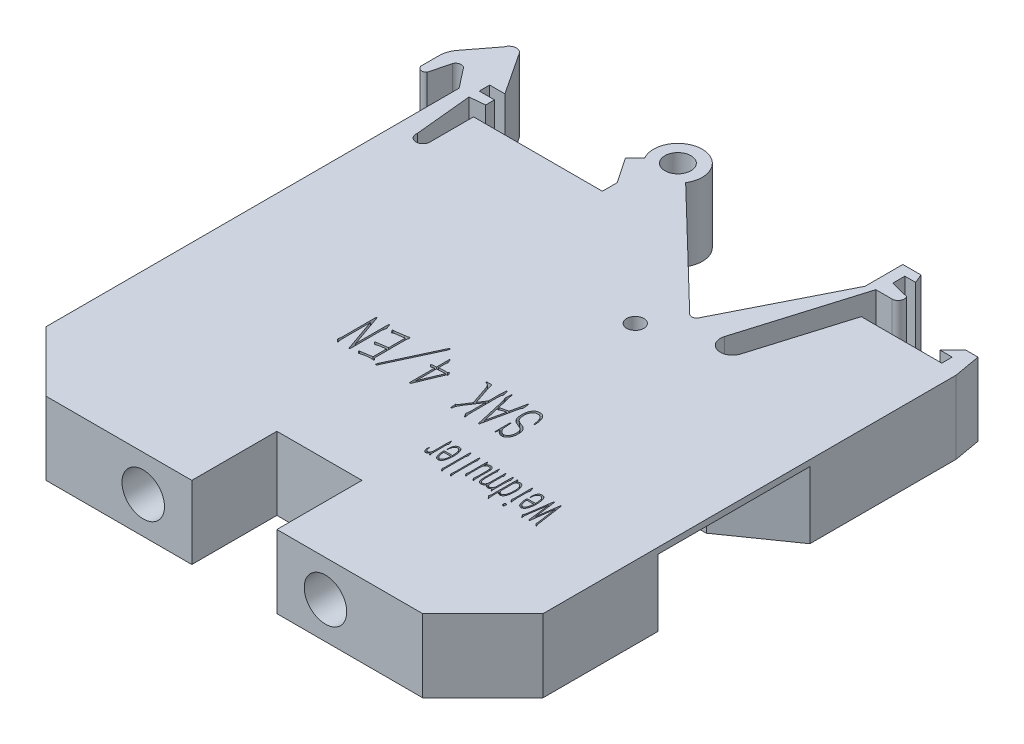
from build123d import *

# Parameters (mm, degrees)
EXTRUDE_1_DEPTH     = 6
SKETCH_2_R          = 1.75
CUT_EXTRUDE_1_DEPTH = 5
SKETCH_3_W          = 0.5
SKETCH_3_H          = 2.824973596
CUT_EXTRUDE_2_DEPTH = 1
SKETCH_4_R          = 1.074642803
CUT_EXTRUDE_3_DEPTH = 51.853106528
SKETCH_5_R          = 0.707865735
CUT_EXTRUDE_4_DEPTH = 51.853106528
SKETCH_6_W          = 12.5
SKETCH_6_H          = 5.5
CUT_EXTRUDE_5_DEPTH = 5
EXTRUDE_2_DEPTH     = 5.5
SKETCH_8_W          = 5.482141003
SKETCH_8_H          = 4.660811604
CUT_EXTRUDE_6_DEPTH = 10
CUT_EXTRUDE_7_DEPTH = 1


with BuildPart() as part:
    # 草图1 → 凸台-拉伸1 (new body)
    with BuildSketch(Plane(origin=(0, 0, 0), x_dir=(1, 0, 0), z_dir=(0, 1, 0))):
        with BuildLine():
            Line((-3.5, 7), (3.5, 7))
            Line((3.5, 7), (3.5, 0))
            Line((3.5, 0), (15.5, 0))
            Line((15.5, 0), (20.449747468, 4.949747468))
            Line((20.449747468, 4.949747468), (20.449747468, 38.949747468))
            Line((20.449747468, 38.949747468), (20.064730394, 41.133287802))
            Line((20.064730394, 41.133287802), (19.064730394, 41.133287802))
            Line((19.064730394, 41.133287802), (18.004070222, 40.072627631))
            Line((18.004070222, 40.072627631), (19.004070222, 40.072627631))
            Line((19.004070222, 40.072627631), (19.004070222, 39.212627631))
            Line((19.004070222, 39.212627631), (12.379866438, 39.212627631))
            Line((12.379866438, 39.212627631), (10.080468168, 31.585457023))
            ThreePointArc((10.080468168, 31.585457023), (8.834388447, 30.916663087), (8.165594511, 32.162742809))
            Line((8.165594511, 32.162742809), (11.052023437, 41.737111093))
            Line((11.052023437, 41.737111093), (12.389611309, 41.737111093))
            ThreePointArc((12.389611309, 41.737111093), (12.830330838, 42.000962207), (12.805913013, 42.514045907))
            Line((12.805913013, 42.514045907), (11.286732691, 42.892893868))
            Line((11.286732691, 42.892893868), (11.286732691, 43.892065664))
            Line((11.286732691, 43.892065664), (12.170224569, 43.892065664))
            Line((12.170224569, 43.892065664), (11.860762457, 44.644557886))
            Line((11.860762457, 44.644557886), (10.368190502, 44.644557886))
            Line((10.368190502, 44.644557886), (10.368190502, 41.538852695))
            Line((10.368190502, 41.538852695), (5.782070188, 32.447590196))
            ThreePointArc((5.782070188, 32.447590196), (5.482003984, 32.228621058), (5.1289267, 32.344049136))
            Line((5.1289267, 32.344049136), (-4.399356342, 41.538852695))
            ThreePointArc((-4.399356342, 41.538852695), (-6.070259894, 44.606700778), (-7.832974006, 41.590668699))
            Line((-7.832974006, 41.590668699), (-8.620624405, 40.8030183))
            Line((-8.620624405, 40.8030183), (-7.212825116, 38.724485999))
            Line((-7.212825116, 38.724485999), (-7.212825116, 37.497763327))
            Line((-7.212825116, 37.497763327), (-17.812825116, 37.497763327))
            Line((-17.812825116, 37.497763327), (-17.812825116, 33.912648315))
            ThreePointArc((-17.812825116, 33.912648315), (-18.450618593, 33.338743648), (-18.954270089, 34.033353076))
            Line((-18.954270089, 34.033353076), (-19.418791581, 38.724485999))
            Line((-19.418791581, 38.724485999), (-18.163465707, 38.848789842))
            Line((-18.163465707, 38.848789842), (-18.163465707, 39.572627631))
            Line((-18.163465707, 39.572627631), (-19.418791581, 39.572627631))
            Line((-19.418791581, 39.572627631), (-19.418791581, 40.429015674))
            Line((-19.418791581, 40.429015674), (-18.163465707, 40.429015674))
            Line((-18.163465707, 40.429015674), (-20.449747468, 43.892065664))
            ThreePointArc((-20.449747468, 43.892065664), (-21.052060742, 44.163300452), (-21.55506542, 43.735123056))
            Line((-21.55506542, 43.735123056), (-23.203821693, 41.590668699))
            ThreePointArc((-23.203821693, 41.590668699), (-23.497332718, 41.042493682), (-23.598768925, 40.429015674))
            Line((-23.598768925, 40.429015674), (-23.598768925, 38.949747468))
            ThreePointArc((-23.598768925, 38.949747468), (-23.303112935, 38.648807164), (-22.900033631, 38.773324657))
            Line((-22.900033631, 38.773324657), (-22.484949258, 40.429015674))
            ThreePointArc((-22.484949258, 40.429015674), (-22.074041412, 40.719654173), (-21.63895448, 40.46664161))
            Line((-21.63895448, 40.46664161), (-20.449747468, 38.949747468))
            Line((-20.449747468, 38.949747468), (-20.449747468, 4.949747468))
            Line((-20.449747468, 4.949747468), (-15.5, 0))
            Line((-15.5, 0), (-3.5, 0))
            Line((-3.5, 0), (-3.5, 7))
        make_face()
    extrude(amount=EXTRUDE_1_DEPTH)

    # 草图2 → 切除-拉伸1 (cut)
    with BuildSketch(Plane.XY):
        with Locations((-7.5, 3)):
            Circle(SKETCH_2_R)
        with Locations((7.5, 3)):
            Circle(SKETCH_2_R)
    extrude(amount=-CUT_EXTRUDE_1_DEPTH, mode=Mode.SUBTRACT)

    # 草图3 → 切除-拉伸2 (cut)
    with BuildSketch(Plane.XY.offset(-5)):
        with Locations((-7.5, 3)):
            Rectangle(SKETCH_3_W, SKETCH_3_H)
        with Locations((7.5, 3)):
            Rectangle(SKETCH_3_W, SKETCH_3_H)
    extrude(amount=-CUT_EXTRUDE_2_DEPTH, mode=Mode.SUBTRACT)

    # 草图4 → 切除-拉伸3 (cut, through all)
    with BuildSketch(Plane(origin=(0, 6, 0), x_dir=(1, 0, 0), z_dir=(0, 1, 0))):
        with Locations(Location((-6.100523508, 42.601264823, 0), (0, 0, 270))):
            Circle(SKETCH_4_R)
    extrude(amount=-CUT_EXTRUDE_3_DEPTH, mode=Mode.SUBTRACT)

    # 草图5 → 切除-拉伸4 (cut, through all)
    with BuildSketch(Plane(origin=(0, 6, 0), x_dir=(1, 0, 0), z_dir=(0, 1, 0))):
        with Locations(Location((3.558550991, 29.433022389, 0), (0, 0, 270))):
            Circle(SKETCH_5_R)
    extrude(amount=-CUT_EXTRUDE_4_DEPTH, mode=Mode.SUBTRACT)

    # 草图6 → 切除-拉伸5 (cut)
    with BuildSketch(Plane.ZY.offset(20.449747468)):
        with Locations((-20.665127281, 2.75)):
            Rectangle(SKETCH_6_W, SKETCH_6_H)
    cut_extrude_5 = extrude(amount=-CUT_EXTRUDE_5_DEPTH, mode=Mode.SUBTRACT)

    # 草图7 → 凸台-拉伸2 (add)
    with BuildSketch(Plane.XZ.offset(-5.5)):
        Polygon((-20.449747468, -26.915127281), (-15.449747468, -26.915127281), (-15.449747468, -23.415127281), align=None)
        Polygon((-20.449747468, -14.415127281), (-15.449747468, -14.415127281), (-15.449747468, -17.915127281), align=None)
    extrude_2 = extrude(amount=EXTRUDE_2_DEPTH)

    # 草图8 → 切除-拉伸6 (cut)
    with BuildSketch(Plane.ZY.offset(15.449747468)):
        with Locations((-20.656197783, 2.330405802)):
            Rectangle(SKETCH_8_W, SKETCH_8_H)
    cut_extrude_6 = extrude(amount=-CUT_EXTRUDE_6_DEPTH, mode=Mode.SUBTRACT)

    # 镜向1: 切除-拉伸5, 凸台-拉伸2, 切除-拉伸6 across plane
    add(cut_extrude_5.mirror(Plane(origin=(0, 0, 0), x_dir=(0, 0, 1), z_dir=(1, 0, 0))), mode=Mode.SUBTRACT)
    add(extrude_2.mirror(Plane(origin=(0, 0, 0), x_dir=(0, 0, 1), z_dir=(1, 0, 0))))
    add(cut_extrude_6.mirror(Plane(origin=(0, 0, 0), x_dir=(0, 0, 1), z_dir=(1, 0, 0))), mode=Mode.SUBTRACT)

    # 草图9 → 切除-拉伸7 (cut)
    # profile 1 of 18: a face of its own
    with BuildSketch(Plane(origin=(0, 6, 0), x_dir=(1, 0, 0), z_dir=(0, 1, 0))):
        with BuildLine():
            Line((13.505399565, 12.891650445), (13.265697118, 11.022190264))
            Line((13.265697118, 11.022190264), (13.187985366, 11.022190264))
            Line((13.187985366, 11.022190264), (12.955397375, 12.876874267))
            Line((12.955397375, 12.876874267), (12.737038296, 11.362042364))
            add(Edge.make_bspline(
                [(12.737038296, 11.362042364), (12.733711925, 11.337624731), (12.727371072, 11.291078929), (12.721778696, 11.223670912), (12.719954495, 11.160658765), (12.719300866, 11.119968674), (12.718978523, 11.099902017)],
                knots=[0, 0, 0, 0, 1.12427698, 2.14313875, 3.084273374, 4, 4, 4, 4], degree=3))
            add(Edge.make_bspline(
                [(12.718978523, 11.099902017), (12.719548138, 11.090782078), (12.720584555, 11.074188339), (12.721694033, 11.051567801), (12.722350657, 11.033686673), (12.722288347, 11.023285111), (12.722262118, 11.018906669)],
                knots=[0, 0, 0, 0, 1.352376053, 2.460649923, 3.352024802, 4, 4, 4, 4], degree=3))
            Line((12.722262118, 11.018906669), (12.733754701, 10.959801956))
            Line((12.733754701, 10.959801956), (12.696540623, 10.937364056))
            Line((12.696540623, 10.937364056), (12.563555018, 11.169952047))
            add(Edge.make_bspline(
                [(12.563555018, 11.169952047), (12.569758445, 11.179420382), (12.579777326, 11.194712273), (12.588290555, 11.214768165), (12.59318102, 11.229761173), (12.597744946, 11.244976582), (12.605973032, 11.264778436), (12.615147166, 11.288469422), (12.624393494, 11.312801549), (12.632047319, 11.334900491), (12.635900448, 11.353527642), (12.636967468, 11.364768944), (12.63743591, 11.369704086)],
                knots=[0, 0, 0, 0, 1.580980541, 2.553371956, 3.037888227, 3.788931859, 4.775305656, 6.036703337, 7.345794211, 8.419835634, 9.306278274, 10, 10, 10, 10], degree=3))
            Line((12.63743591, 11.369704086), (12.929128613, 13.386378783))
            Line((12.929128613, 13.386378783), (12.988233326, 13.386378783))
            Line((12.988233326, 13.386378783), (13.228483039, 11.554132681))
            Line((13.228483039, 11.554132681), (13.479678069, 13.386378783))
            Line((13.479678069, 13.386378783), (13.534951921, 13.386378783))
            Line((13.534951921, 13.386378783), (13.834306347, 11.34015173))
            add(Edge.make_bspline(
                [(13.834306347, 11.34015173), (13.837415332, 11.318960971), (13.844139446, 11.273129592), (13.85571658, 11.215823344), (13.865406975, 11.169890733), (13.872395194, 11.140838356), (13.876713125, 11.117990263), (13.881771423, 11.099983187), (13.887311891, 11.083093076), (13.893994078, 11.063247467), (13.901983098, 11.03866389), (13.908487736, 11.020891068), (13.912018099, 11.011244947)],
                knots=[0, 0, 0, 0, 1.896873338, 4.102558193, 5.176977938, 6.05508091, 6.749164711, 7.235278581, 7.7105282, 8.323718067, 9.090205401, 10, 10, 10, 10], degree=3))
            Line((13.912018099, 11.011244947), (13.933908734, 10.959801956))
            Line((13.933908734, 10.959801956), (13.908187238, 10.922587878))
            Line((13.908187238, 10.922587878), (13.723758643, 11.081294977))
            add(Edge.make_bspline(
                [(13.723758643, 11.081294977), (13.726006512, 11.092592713), (13.730056785, 11.112949294), (13.735283026, 11.143724293), (13.738097179, 11.178652501), (13.738735792, 11.214094748), (13.738224679, 11.250067839), (13.735899125, 11.282930407), (13.731915505, 11.31957422), (13.728720549, 11.345263954), (13.727042239, 11.358758769)],
                knots=[0, 0, 0, 0, 0.990438925, 1.784600986, 2.682008007, 3.999817028, 4.831204135, 5.774318449, 6.830849758, 8, 8, 8, 8], degree=3))
            Line((13.727042239, 11.358758769), (13.505399565, 12.891650445))
        make_face()
    # profile 2 of 18: a face of its own
    with BuildSketch(Plane(origin=(0, 6, 0), x_dir=(1, 0, 0), z_dir=(0, 1, 0))):
        with BuildLine():
            add(Edge.make_bspline(
                [(12.280071302, 12.496524493), (12.279944807, 12.529912995), (12.27969999, 12.594532848), (12.275316684, 12.69134058), (12.265788609, 12.791215207), (12.248919419, 12.877537414), (12.233520397, 12.949029347), (12.218388901, 12.999254276), (12.202873304, 13.04522326), (12.184633202, 13.086338168), (12.164955223, 13.123627376), (12.14023318, 13.15548634), (12.111666473, 13.18253348), (12.079368188, 13.204229957), (12.045161001, 13.220859416), (12.009567378, 13.230732443), (11.973272407, 13.23497908), (11.949153664, 13.232671511), (11.936935608, 13.231502545)],
                knots=[0, 0, 0, 0, 1.762136233, 3.410425077, 5.113895609, 7.051610907, 8.048994725, 8.972184714, 9.818733913, 10.607690534, 11.344639035, 12.037963998, 12.72591947, 13.412255904, 14.084121409, 14.724259383, 15.353736164, 16, 16, 16, 16], degree=3))
            add(Edge.make_bspline(
                [(11.936935608, 13.231502545), (11.919564397, 13.228846427), (11.883874162, 13.223389269), (11.833504081, 13.199302066), (11.787348895, 13.164758673), (11.754132953, 13.12672665), (11.732068861, 13.089161681), (11.715999056, 13.054010403), (11.701783271, 13.012080528), (11.683737094, 12.94837238), (11.666928532, 12.865662562), (11.659706578, 12.798499486), (11.656188221, 12.765779297)],
                knots=[0, 0, 0, 0, 0.884971188, 1.818228493, 2.78716504, 3.788091118, 4.346745266, 4.986743206, 5.739713658, 6.583908749, 8.335764848, 10, 10, 10, 10], degree=3))
            Line((11.656188221, 12.765779297), (11.65235736, 12.68478395))
            Line((11.65235736, 12.68478395), (11.611859686, 12.68478395))
            add(Edge.make_bspline(
                [(11.611859686, 12.68478395), (11.612196479, 12.71378726), (11.612853206, 12.770342079), (11.614309959, 12.854723925), (11.620934048, 12.939049502), (11.629907034, 13.025452777), (11.649581555, 13.112218304), (11.677051162, 13.181625606), (11.706169225, 13.232039103), (11.729365932, 13.266595562), (11.756077437, 13.295636056), (11.784697047, 13.321112619), (11.817810867, 13.341187327), (11.855510523, 13.356023274), (11.898218616, 13.365218751), (11.928316477, 13.367254714), (11.944050064, 13.36831901)],
                knots=[0, 0, 0, 0, 1.433882338, 2.795989598, 4.170221094, 5.614190475, 7.086267868, 8.554805811, 9.281813015, 9.962194722, 10.606987156, 11.227094241, 11.850340467, 12.51009238, 13.221154258, 14, 14, 14, 14], degree=3))
            add(Edge.make_bspline(
                [(11.944050064, 13.36831901), (11.957741383, 13.368870546), (11.985583558, 13.369992129), (12.02908748, 13.364566022), (12.076655437, 13.352352104), (12.118027666, 13.333325187), (12.153486541, 13.313297166), (12.180538231, 13.29289488), (12.205901762, 13.267266823), (12.231753675, 13.238063372), (12.256173403, 13.202543774), (12.277936411, 13.159234225), (12.297287113, 13.108337381), (12.320206016, 13.030504239), (12.34379701, 12.926935818), (12.361841935, 12.818913631), (12.37110737, 12.72576517), (12.376147144, 12.645089963), (12.377294797, 12.553804926), (12.376702278, 12.489408472), (12.376390094, 12.455479554)],
                knots=[0, 0, 0, 0, 0.650892177, 1.323630895, 2.077151028, 2.978514147, 3.480102479, 4.012921675, 4.583614278, 5.192607284, 5.86657618, 6.6272577, 7.49264712, 8.453494528, 10.484783578, 12.541987508, 13.658458761, 14.936482626, 16.385907541, 18, 18, 18, 18], degree=3))
            add(Edge.make_bspline(
                [(12.376390094, 12.455479554), (12.375506397, 12.430487192), (12.373803139, 12.382316319), (12.370886178, 12.31276171), (12.365831892, 12.248543053), (12.357930206, 12.171467156), (12.346469765, 12.082902784), (12.325846099, 11.983576197), (12.298877446, 11.88880542), (12.26783836, 11.813314099), (12.238779259, 11.755354022), (12.213075573, 11.717244644), (12.18376046, 11.685189829), (12.152078125, 11.658909828), (12.119202738, 11.638530183), (12.087438081, 11.621903426), (12.056537093, 11.609296541), (12.035704803, 11.60458102), (12.025592677, 11.602292077)],
                knots=[0, 0, 0, 0, 1.213254056, 2.338454759, 3.376961, 4.337703347, 6.097447331, 7.706415981, 9.255161951, 10.870664585, 11.658362253, 12.397216084, 13.092544982, 13.758825418, 14.387360726, 14.965258123, 15.497729695, 16, 16, 16, 16], degree=3))
            add(Edge.make_bspline(
                [(12.025592677, 11.602292077), (12.010827386, 11.600570985), (11.981405757, 11.597141502), (11.936495104, 11.603271961), (11.89225562, 11.617984673), (11.848866782, 11.640318067), (11.808284185, 11.669675435), (11.771867812, 11.704643288), (11.73968532, 11.744052299), (11.705337875, 11.80386069), (11.671878479, 11.883893684), (11.643539095, 11.981738196), (11.626591931, 12.07486873), (11.613160698, 12.157694313), (11.60622965, 12.229603051), (11.599663543, 12.293194043), (11.598230288, 12.352766116), (11.596799939, 12.400581251), (11.59732776, 12.435965781), (11.598788106, 12.457097031), (11.60127095, 12.472228141), (11.604864743, 12.484135836), (11.615592556, 12.491030155), (11.631790237, 12.493707559), (11.654445589, 12.49673633), (11.672041664, 12.496600608), (11.681909717, 12.496524493)],
                knots=[0, 0, 0, 0, 0.906605631, 1.806521371, 2.745464054, 3.748872433, 4.780444398, 5.79888872, 6.830883324, 7.881839338, 10.007036246, 12.12292051, 14.101853907, 15.795734178, 17.255194944, 18.521439439, 19.705462147, 20.900013433, 21.447069289, 21.872548139, 22.190030376, 22.395242738, 22.602869447, 22.92502652, 23.397144282, 24, 24, 24, 24], degree=3))
            Line((11.681909717, 12.496524493), (12.280071302, 12.496524493))
        make_face()
        with BuildLine():
            add(Edge.make_bspline(
                [(11.700516756, 12.370653345), (11.700844419, 12.345472559), (11.70151947, 12.293595121), (11.706912225, 12.213132181), (11.71862078, 12.126009542), (11.734685786, 12.050103677), (11.750314976, 11.988349929), (11.765050627, 11.945809496), (11.779718695, 11.907593378), (11.802031016, 11.864353224), (11.834955774, 11.818920213), (11.87348941, 11.781253911), (11.907801097, 11.759376132), (11.934070607, 11.748050951), (11.960928554, 11.740168811), (11.979202333, 11.739462979), (11.988378599, 11.739108542)],
                knots=[0, 0, 0, 0, 1.401498202, 2.887365554, 4.485580624, 6.289686032, 7.203377874, 8.028555173, 8.794042308, 9.479752962, 10.730887343, 11.901700773, 12.453824643, 12.985788389, 13.490708791, 14, 14, 14, 14], degree=3))
            add(Edge.make_bspline(
                [(11.988378599, 11.739108542), (11.999962245, 11.740492863), (12.022918374, 11.743236268), (12.056290682, 11.75532419), (12.08762894, 11.77433336), (12.117026446, 11.799621301), (12.143721946, 11.830359748), (12.167132405, 11.865618193), (12.18777259, 11.904708495), (12.209128494, 11.963718578), (12.231234866, 12.04289855), (12.247874548, 12.12482695), (12.258811357, 12.190480423), (12.264972121, 12.236632685), (12.268395223, 12.279206886), (12.268889291, 12.306253192), (12.269125985, 12.319210355)],
                knots=[0, 0, 0, 0, 0.702215769, 1.39163045, 2.122264132, 2.903167055, 3.72231811, 4.571112816, 5.452477709, 6.382741783, 8.35153412, 10.409057006, 11.4243454, 12.367867756, 13.218089009, 14, 14, 14, 14], degree=3))
            Line((12.269125985, 12.319210355), (12.272956846, 12.370653345))
            Line((12.272956846, 12.370653345), (11.700516756, 12.370653345))
        make_face(mode=Mode.SUBTRACT)
    # profile 3 of 18: a face of its own
    with BuildSketch(Plane(origin=(0, 6, 0), x_dir=(1, 0, 0), z_dir=(0, 1, 0))):
        with BuildLine():
            Line((11.205241152, 11.620899116), (11.175688795, 11.583685038))
            Line((11.175688795, 11.583685038), (11.009867239, 11.798213255))
            add(Edge.make_bspline(
                [(11.009867239, 11.798213255), (11.01428844, 11.810363576), (11.022191368, 11.83208236), (11.030840739, 11.865840369), (11.037693272, 11.904304796), (11.044232197, 11.94330113), (11.049230504, 11.982728143), (11.051226909, 12.018550134), (11.051775476, 12.058354514), (11.05084926, 12.086259114), (11.050364913, 12.100851276)],
                knots=[0, 0, 0, 0, 1.009205721, 1.803962369, 2.717641552, 4.059708212, 4.892013242, 5.81980073, 6.859907636, 8, 8, 8, 8], degree=3))
            Line((11.050364913, 12.100851276), (11.046534052, 13.139014614))
            Line((11.046534052, 13.139014614), (11.046534052, 13.272000218))
            add(Edge.make_bspline(
                [(11.046534052, 13.272000218), (11.046644566, 13.299253249), (11.046847332, 13.349255677), (11.052295948, 13.407449017), (11.056014677, 13.446018115), (11.062125003, 13.463097806), (11.064380358, 13.476777325), (11.070243544, 13.478332903), (11.072255548, 13.478866714)],
                knots=[0, 0, 0, 0, 2.301498112, 4.222667704, 4.987065429, 5.515302984, 5.83367201, 6, 6, 6, 6], degree=3))
            add(Edge.make_bspline(
                [(11.072255548, 13.478866714), (11.074765612, 13.478589709), (11.080202407, 13.477989717), (11.086668405, 13.469822099), (11.094356744, 13.456865108), (11.103829121, 13.437244467), (11.115816904, 13.414728247), (11.121519551, 13.398139969), (11.124245804, 13.390209644)],
                knots=[0, 0, 0, 0, 0.413918326, 0.896546128, 1.662794511, 3.022573531, 4.576587735, 6, 6, 6, 6], degree=3))
            Line((11.124245804, 13.390209644), (11.168574339, 13.25722404))
            add(Edge.make_bspline(
                [(11.168574339, 13.25722404), (11.171842068, 13.248461919), (11.177691198, 13.232778006), (11.18549236, 13.212464732), (11.190159444, 13.197638675), (11.195010896, 13.186233039), (11.197466316, 13.173113287), (11.195450046, 13.163261373), (11.194295835, 13.157621653)],
                knots=[0, 0, 0, 0, 1.610684889, 2.88307366, 3.747535533, 4.284430495, 5.017923802, 6, 6, 6, 6], degree=3))
            add(Edge.make_bspline(
                [(11.194295835, 13.157621653), (11.193482427, 13.153397893), (11.19112778, 13.141170967), (11.182520028, 13.120663203), (11.173454307, 13.094662717), (11.163748814, 13.066162929), (11.158126078, 13.03316022), (11.153390825, 12.997022864), (11.151124674, 12.961180383), (11.14989888, 12.935439446), (11.149981653, 12.918101397), (11.149960995, 12.904784927), (11.149969709, 12.886907435), (11.149966428, 12.864287166), (11.149967596, 12.837106276), (11.149967202, 12.805182441), (11.149967329, 12.768698048), (11.14996731, 12.742794131), (11.1499673, 12.729112484)],
                knots=[0, 0, 0, 0, 0.474563025, 1.37376325, 2.445211898, 3.522902599, 4.693355563, 6.136330548, 7.551283934, 8.660940665, 8.98353668, 9.467430702, 10.132784982, 10.95943727, 11.967549816, 13.136960369, 14.487831181, 16, 16, 16, 16], degree=3))
            Line((11.1499673, 12.729112484), (11.1499673, 12.075129781))
            add(Edge.make_bspline(
                [(11.1499673, 12.075129781), (11.15012521, 12.068197016), (11.150536827, 12.050125744), (11.152213389, 12.016904996), (11.155923318, 11.971535503), (11.159043685, 11.918033876), (11.163452853, 11.864435336), (11.16669943, 11.818746723), (11.170952454, 11.785084464), (11.174231811, 11.754590687), (11.181891311, 11.721036105), (11.187414384, 11.694603499), (11.190464974, 11.680003829)],
                knots=[0, 0, 0, 0, 0.522936528, 1.36311098, 2.507898653, 3.955561121, 5.404203704, 6.56377404, 7.408441435, 7.962992748, 8.874888268, 10, 10, 10, 10], degree=3))
            Line((11.190464974, 11.680003829), (11.205241152, 11.620899116))
        make_face()
    # profile 4 of 18: a face of its own
    with BuildSketch(Plane(origin=(0, 6, 0), x_dir=(1, 0, 0), z_dir=(0, 1, 0))):
        with BuildLine():
            add(Edge.make_bspline(
                [(11.190464974, 11.148061412), (11.19021508, 11.13893297), (11.1896183, 11.117133022), (11.185488655, 11.082217394), (11.177451857, 11.044684086), (11.163972541, 11.016075273), (11.148425757, 10.997687809), (11.132344026, 10.989547762), (11.113300672, 10.985696371), (11.092480483, 10.986648741), (11.071149911, 10.9906585), (11.053058104, 11.002041198), (11.037568855, 11.016984142), (11.023447496, 11.044752267), (11.012037144, 11.085169697), (11.010610313, 11.119327299), (11.009867239, 11.137116095)],
                knots=[0, 0, 0, 0, 0.947030444, 2.26163592, 3.643325183, 4.912884611, 5.502315166, 6.10347833, 6.741915126, 7.499170639, 8.25666261, 8.960985277, 9.683631172, 10.463029917, 12.157996094, 14, 14, 14, 14], degree=3))
            add(Edge.make_bspline(
                [(11.009867239, 11.137116095), (11.012873274, 11.154426511), (11.018528434, 11.186992059), (11.033667952, 11.224413427), (11.050265411, 11.248859385), (11.067464549, 11.260593316), (11.087680062, 11.267064886), (11.101941863, 11.266545163), (11.109469626, 11.266270838)],
                knots=[0, 0, 0, 0, 1.727880391, 3.250607675, 3.944616269, 4.60301063, 5.262631281, 6, 6, 6, 6], degree=3))
            add(Edge.make_bspline(
                [(11.109469626, 11.266270838), (11.11590217, 11.26585001), (11.128169295, 11.265047473), (11.145405244, 11.25892499), (11.15967819, 11.247848614), (11.175097612, 11.227255513), (11.188430684, 11.193367726), (11.189753973, 11.163896323), (11.190464974, 11.148061412)],
                knots=[0, 0, 0, 0, 0.719617656, 1.372340468, 2.013778014, 2.712507146, 4.233638419, 6, 6, 6, 6], degree=3))
        make_face()
    # profile 5 of 18: a face of its own
    with BuildSketch(Plane(origin=(0, 6, 0), x_dir=(1, 0, 0), z_dir=(0, 1, 0))):
        with BuildLine():
            add(Edge.make_bspline(
                [(9.960211318, 13.231502545), (9.966582614, 13.237716543), (9.97812757, 13.248976471), (9.994117351, 13.264237107), (10.007738971, 13.275375311), (10.023082873, 13.288148832), (10.047885933, 13.300438151), (10.083828754, 13.313544723), (10.125993454, 13.325643063), (10.156060868, 13.329299379), (10.170908675, 13.331104931)],
                knots=[0, 0, 0, 0, 0.892903414, 1.617964525, 2.215417032, 2.658386297, 3.616416726, 4.965704087, 6.501612377, 8, 8, 8, 8], degree=3))
            add(Edge.make_bspline(
                [(10.170908675, 13.331104931), (10.182027555, 13.331884885), (10.204820798, 13.333483757), (10.239673556, 13.331452968), (10.275264061, 13.3236308), (10.310939858, 13.313273267), (10.344782772, 13.299165694), (10.375489812, 13.283150354), (10.400875459, 13.263120448), (10.429501398, 13.232417721), (10.461294074, 13.186677232), (10.4965831, 13.125174152), (10.530273531, 13.05831119), (10.553595275, 12.998933231), (10.569181811, 12.947782119), (10.579753539, 12.903681402), (10.590423241, 12.853567064), (10.601995742, 12.780042841), (10.614838365, 12.687580365), (10.618334904, 12.57844447), (10.616544352, 12.472374148), (10.612435056, 12.402202709), (10.610363161, 12.366822484)],
                knots=[0, 0, 0, 0, 0.561379099, 1.150803861, 1.751094182, 2.393799424, 3.020261351, 3.596127638, 4.133043624, 4.640179281, 5.706589635, 6.929966163, 8.212514216, 9.475646454, 10.138605952, 10.905504014, 11.75999789, 12.719564715, 14.655464655, 16.458562752, 18.214418182, 20, 20, 20, 20], degree=3))
            add(Edge.make_bspline(
                [(10.610363161, 12.366822484), (10.607099454, 12.317133734), (10.600797801, 12.221193342), (10.582859902, 12.104958062), (10.563940236, 12.020029883), (10.550045829, 11.963248109), (10.534338251, 11.912618105), (10.512198533, 11.854510085), (10.480848637, 11.79122651), (10.443096146, 11.735903679), (10.409222599, 11.699583693), (10.383057152, 11.677039958), (10.355254771, 11.658742522), (10.326002373, 11.644057747), (10.293946174, 11.634390723), (10.259505363, 11.627619998), (10.221609351, 11.625645266), (10.195527335, 11.627199024), (10.181853992, 11.628013572)],
                knots=[0, 0, 0, 0, 2.497356063, 4.821963015, 5.890034002, 6.862213378, 7.753728528, 8.547439322, 9.979886657, 11.287408761, 11.889537581, 12.467247448, 13.015502132, 13.555754915, 14.102786156, 14.689700842, 15.31308335, 16, 16, 16, 16], degree=3))
            add(Edge.make_bspline(
                [(10.181853992, 11.628013572), (10.16922668, 11.630942004), (10.143450239, 11.636919882), (10.104129693, 11.649579732), (10.064072505, 11.67239877), (10.028530798, 11.706299771), (9.99862703, 11.740714162), (9.981827644, 11.763296847), (9.974987497, 11.77249176)],
                knots=[0, 0, 0, 0, 0.896673248, 1.83040095, 2.84769195, 4.053811443, 5.207577174, 6, 6, 6, 6], degree=3))
            Line((9.974987497, 11.77249176), (9.956380457, 11.809158572))
            Line((9.956380457, 11.809158572), (9.956380457, 11.39159472))
            add(Edge.make_bspline(
                [(9.956380457, 11.39159472), (9.956261617, 11.375175171), (9.956037109, 11.344155907), (9.957528923, 11.300019917), (9.958323827, 11.260965166), (9.960613946, 11.215148737), (9.964784903, 11.16016178), (9.971110997, 11.106211592), (9.976777774, 11.064998617), (9.981000887, 11.039416891), (9.985242622, 11.019689595), (9.988441921, 11.008679279), (9.989763675, 11.004130491)],
                knots=[0, 0, 0, 0, 1.263431071, 2.38683181, 3.39796654, 4.269348467, 5.916661042, 7.640551694, 8.448567324, 9.117848733, 9.635549129, 10, 10, 10, 10], degree=3))
            Line((9.989763675, 11.004130491), (10.008370714, 10.945025778))
            Line((10.008370714, 10.945025778), (9.974987497, 10.907811699))
            Line((9.974987497, 10.907811699), (9.808618675, 11.125623512))
            add(Edge.make_bspline(
                [(9.808618675, 11.125623512), (9.813185389, 11.138149935), (9.821392787, 11.160662698), (9.83073094, 11.194474588), (9.839646762, 11.229242618), (9.847025579, 11.26295258), (9.852031378, 11.297704683), (9.853842807, 11.333012643), (9.854335384, 11.376276272), (9.853435951, 11.407831291), (9.85294721, 11.424977938)],
                knots=[0, 0, 0, 0, 1.048359807, 1.884135396, 2.757739103, 3.872270807, 4.596784634, 5.516997527, 6.650764085, 8, 8, 8, 8], degree=3))
            Line((9.85294721, 11.424977938), (9.85294721, 13.142845475))
            Line((9.85294721, 13.142845475), (9.860608932, 13.34971197))
            add(Edge.make_bspline(
                [(9.860608932, 13.34971197), (9.860931886, 13.366727283), (9.861518357, 13.397626319), (9.866949146, 13.433440792), (9.873115423, 13.45613102), (9.876714541, 13.466185207), (9.881518473, 13.473176636), (9.884993773, 13.472147918), (9.886330427, 13.471752257)],
                knots=[0, 0, 0, 0, 2.345488946, 4.259301401, 5.017308716, 5.536758502, 5.821830193, 6, 6, 6, 6], degree=3))
            add(Edge.make_bspline(
                [(9.886330427, 13.471752257), (9.888013591, 13.47129057), (9.892855645, 13.469962406), (9.90109125, 13.462508736), (9.911784951, 13.446531262), (9.917648865, 13.425855378), (9.923656101, 13.407332746), (9.927476596, 13.39591097), (9.930032947, 13.388302166), (9.930504738, 13.384377971), (9.930658962, 13.383095188)],
                knots=[0, 0, 0, 0, 0.404869445, 1.164711592, 2.514276409, 4.876978618, 6.132146454, 7.076841826, 7.698228133, 8, 8, 8, 8], degree=3))
            Line((9.930658962, 13.383095188), (9.956380457, 13.338766653))
            add(Edge.make_bspline(
                [(9.956380457, 13.338766653), (9.960071251, 13.332298298), (9.966830087, 13.320453001), (9.973086507, 13.30259168), (9.975653547, 13.28617886), (9.97259152, 13.276524371), (9.971156636, 13.272000218)],
                knots=[0, 0, 0, 0, 1.258222532, 2.304143687, 3.20531149, 4, 4, 4, 4], degree=3))
            Line((9.971156636, 13.272000218), (9.960211318, 13.231502545))
        make_face()
        with BuildLine():
            add(Edge.make_bspline(
                [(9.956380457, 12.038462968), (9.959813546, 12.023862022), (9.967703182, 11.99030735), (9.978834219, 11.946054061), (9.993352769, 11.906237308), (10.011791802, 11.875547399), (10.035151513, 11.845290648), (10.063457806, 11.8159712), (10.095158313, 11.789512372), (10.130550043, 11.76892493), (10.167912611, 11.753626664), (10.194319052, 11.748697509), (10.207575487, 11.746222998)],
                knots=[0, 0, 0, 0, 1.086611702, 2.497159991, 3.30457702, 4.14547401, 5.078516649, 6.069205026, 7.09292393, 8.058437083, 9.02530585, 10, 10, 10, 10], degree=3))
            add(Edge.make_bspline(
                [(10.207575487, 11.746222998), (10.224835676, 11.746352504), (10.257800602, 11.746599843), (10.305657282, 11.762898504), (10.346967465, 11.795650447), (10.384276444, 11.842243376), (10.419005098, 11.901707229), (10.442340731, 11.960936057), (10.460288776, 12.014712573), (10.472560938, 12.06197662), (10.484568989, 12.114542769), (10.500265895, 12.193402652), (10.515554258, 12.300775474), (10.519571121, 12.411838116), (10.52018313, 12.50035253), (10.519914641, 12.56075784), (10.517770634, 12.614052117), (10.515226258, 12.647028288), (10.51404437, 12.662346049)],
                knots=[0, 0, 0, 0, 0.783422298, 1.496244245, 2.256452178, 3.154187111, 4.205501914, 5.38401544, 6.049455705, 6.789887053, 7.609051376, 8.507826, 10.455721077, 12.545761308, 13.568829603, 14.492093311, 15.29956228, 16, 16, 16, 16], degree=3))
            add(Edge.make_bspline(
                [(10.51404437, 12.662346049), (10.51087347, 12.701314196), (10.50480136, 12.77593621), (10.486039954, 12.865695601), (10.467892666, 12.931641511), (10.451302763, 12.976265265), (10.43335843, 13.017744379), (10.413086056, 13.055357544), (10.391581547, 13.089390993), (10.367781161, 13.118658459), (10.342715644, 13.143631864), (10.315499402, 13.163536835), (10.286666737, 13.179245548), (10.255803573, 13.190090114), (10.223018571, 13.196962703), (10.200496163, 13.19772775), (10.188968448, 13.198119327)],
                knots=[0, 0, 0, 0, 2.382793278, 4.562927645, 5.580907709, 6.552522086, 7.464308584, 8.335538392, 9.156573158, 9.916028481, 10.632097862, 11.308690416, 11.965880084, 12.627576248, 13.297548003, 14, 14, 14, 14], degree=3))
            add(Edge.make_bspline(
                [(10.188968448, 13.198119327), (10.177819981, 13.198463875), (10.156901021, 13.199110384), (10.127207521, 13.194817288), (10.100629249, 13.188627671), (10.072188105, 13.172595234), (10.041965188, 13.150043827), (10.013177132, 13.11763656), (9.990992111, 13.082203819), (9.973563943, 13.050314211), (9.964347777, 13.017563659), (9.960115647, 12.982975243), (9.956780449, 12.938779615), (9.956522285, 12.905888876), (9.956380457, 12.887819584)],
                knots=[0, 0, 0, 0, 0.902600324, 1.69363726, 2.42946763, 3.097945681, 4.323128942, 5.475755007, 6.587972891, 7.712913435, 8.405994385, 9.333006651, 10.534825171, 12, 12, 12, 12], degree=3))
            Line((9.956380457, 12.887819584), (9.956380457, 12.038462968))
        make_face(mode=Mode.SUBTRACT)
    # profile 6 of 18: a face of its own
    with BuildSketch(Plane(origin=(0, 6, 0), x_dir=(1, 0, 0), z_dir=(0, 1, 0))):
        with BuildLine():
            add(Edge.make_bspline(
                [(8.960903857, 11.812989433), (8.947769964, 11.796601897), (8.922607858, 11.76520641), (8.883266572, 11.722179635), (8.841023627, 11.6862117), (8.792976251, 11.659604527), (8.738812071, 11.64142165), (8.700186836, 11.637637624), (8.68015647, 11.635675294)],
                knots=[0, 0, 0, 0, 1.096444177, 2.100584122, 3.040890774, 3.979023861, 4.951957435, 6, 6, 6, 6], degree=3))
            add(Edge.make_bspline(
                [(8.68015647, 11.635675294), (8.65875778, 11.636483918), (8.616953571, 11.638063634), (8.565871303, 11.649268149), (8.528072425, 11.66473593), (8.50089758, 11.680196827), (8.475242549, 11.700205098), (8.442173145, 11.731703645), (8.406632277, 11.779383043), (8.376211704, 11.847800441), (8.355674132, 11.927626501), (8.340485225, 12.017911514), (8.331449784, 12.115631328), (8.330056352, 12.182376568), (8.329359053, 12.215777107)],
                knots=[0, 0, 0, 0, 0.999941217, 1.953472534, 2.423751282, 2.904956654, 3.409757135, 3.94046504, 5.03698677, 6.162529902, 7.418141914, 8.880198513, 10.438794251, 12, 12, 12, 12], degree=3))
            Line((8.329359053, 12.215777107), (8.329359053, 12.843491049))
            add(Edge.make_bspline(
                [(8.329359053, 12.843491049), (8.329272566, 12.864287863), (8.329089717, 12.908255931), (8.330634091, 12.97775147), (8.331446014, 13.054193142), (8.333109224, 13.13390763), (8.334981559, 13.209788719), (8.335389451, 13.274547645), (8.335530972, 13.324553377), (8.335010447, 13.361175375), (8.33411309, 13.387942416), (8.336739719, 13.407581186), (8.338911947, 13.422573235), (8.346340519, 13.433959514), (8.354903514, 13.441080917), (8.366808919, 13.445827181), (8.376125824, 13.435205498), (8.380328501, 13.422353452), (8.38689733, 13.405148643), (8.392926556, 13.383496661), (8.401234054, 13.354268468), (8.407437724, 13.332380945), (8.410901666, 13.320159614)],
                knots=[0, 0, 0, 0, 1.668298848, 3.527072747, 5.576069855, 7.800901526, 9.923314704, 11.664846041, 12.996558279, 13.933261429, 14.606434648, 15.136507932, 15.526997104, 15.803114645, 16.198508968, 16.439862384, 16.709703707, 17.174785872, 17.563626243, 18.174768394, 18.980845872, 20, 20, 20, 20], degree=3))
            Line((8.410901666, 13.320159614), (8.447568479, 13.201950188))
            add(Edge.make_bspline(
                [(8.447568479, 13.201950188), (8.450136307, 13.194475006), (8.454747869, 13.181050323), (8.460852185, 13.162691141), (8.463404743, 13.147637953), (8.46265531, 13.13883339), (8.462344657, 13.135183753)],
                knots=[0, 0, 0, 0, 1.374116915, 2.467777289, 3.364868378, 4, 4, 4, 4], degree=3))
            Line((8.462344657, 13.135183753), (8.447568479, 13.105631397))
            add(Edge.make_bspline(
                [(8.447568479, 13.105631397), (8.447411109, 13.103621866), (8.446993744, 13.098292346), (8.445154564, 13.088049284), (8.441630283, 13.073586072), (8.438056285, 13.05437757), (8.433093286, 13.030465247), (8.430420572, 13.001128321), (8.427532287, 12.966480801), (8.426325248, 12.941640514), (8.425677845, 12.928317258)],
                knots=[0, 0, 0, 0, 0.270203735, 0.716613359, 1.393229182, 2.266393835, 3.336357224, 4.665493798, 6.211515061, 8, 8, 8, 8], degree=3))
            Line((8.425677845, 12.928317258), (8.421846984, 12.23383688))
            add(Edge.make_bspline(
                [(8.421846984, 12.23383688), (8.42198991, 12.226538843), (8.422322459, 12.209558452), (8.424000191, 12.180341199), (8.427660123, 12.14409977), (8.43210859, 12.08811507), (8.440888851, 12.01930865), (8.452310772, 11.953576019), (8.467044608, 11.906161548), (8.484217835, 11.873195225), (8.507830189, 11.841968157), (8.535525918, 11.812103774), (8.568394797, 11.786519187), (8.606534907, 11.769911425), (8.648297182, 11.761793473), (8.676850682, 11.763793492), (8.691649053, 11.764830038)],
                knots=[0, 0, 0, 0, 0.497562013, 1.157680726, 1.994170897, 2.980397863, 4.985507961, 6.721895191, 7.520170795, 8.359981849, 9.240423141, 10.181642739, 11.131692595, 12.055919028, 12.992444645, 14, 14, 14, 14], degree=3))
            add(Edge.make_bspline(
                [(8.691649053, 11.764830038), (8.703992515, 11.766934231), (8.728157267, 11.771053602), (8.76159545, 11.784695441), (8.791898756, 11.802117518), (8.825653241, 11.832479847), (8.859689529, 11.876036634), (8.882569313, 11.920559321), (8.893472047, 11.954221287), (8.897202848, 11.977650994), (8.901188449, 12.006639085), (8.904369617, 12.041148792), (8.906360877, 12.081498744), (8.907990335, 12.127292299), (8.909062262, 12.178740869), (8.909323606, 12.214864483), (8.909460866, 12.23383688)],
                knots=[0, 0, 0, 0, 0.915191754, 1.791667652, 2.630944826, 3.464879635, 5.102024415, 6.656721008, 7.104991814, 7.689801808, 8.39135468, 9.250838009, 10.228370398, 11.352233425, 12.609372812, 14, 14, 14, 14], degree=3))
            Line((8.909460866, 12.23383688), (8.909460866, 13.201950188))
            add(Edge.make_bspline(
                [(8.909460866, 13.201950188), (8.909408637, 13.21563214), (8.909309049, 13.241720403), (8.909973103, 13.278568642), (8.910588371, 13.311219165), (8.910837732, 13.339328547), (8.91220374, 13.363212473), (8.912957791, 13.382761803), (8.914712749, 13.398105425), (8.916557863, 13.411805598), (8.919799048, 13.424157154), (8.92322475, 13.432921091), (8.92672338, 13.440648281), (8.929979638, 13.43904465), (8.9313515, 13.43836904)],
                knots=[0, 0, 0, 0, 2.017948922, 3.847753773, 5.435434925, 6.834804866, 7.993013013, 8.963122121, 9.720801556, 10.26494144, 11.015420717, 11.535061612, 11.804121468, 12, 12, 12, 12], degree=3))
            add(Edge.make_bspline(
                [(8.9313515, 13.43836904), (8.933235112, 13.437939105), (8.938330961, 13.436775974), (8.944976879, 13.430221961), (8.953081893, 13.422237794), (8.956677903, 13.411637443), (8.960259307, 13.401014736), (8.964042597, 13.388696813), (8.96959789, 13.372556382), (8.973517864, 13.360302048), (8.975680035, 13.353542832)],
                knots=[0, 0, 0, 0, 0.45949356, 1.243096057, 2.178793402, 3.184338218, 3.880221149, 4.896305551, 6.288071414, 8, 8, 8, 8], degree=3))
            Line((8.975680035, 13.353542832), (9.020008569, 13.227671684))
            add(Edge.make_bspline(
                [(9.020008569, 13.227671684), (9.024241913, 13.216007979), (9.0316248, 13.195666655), (9.040795175, 13.169033468), (9.045932697, 13.150410566), (9.046343842, 13.135206244), (9.040918564, 13.121514382), (9.034073062, 13.104142058), (9.026222172, 13.081358157), (9.01869752, 13.057796967), (9.014027818, 13.03258643), (9.010672777, 13.007040988), (9.009366155, 12.97539388), (9.009170393, 12.952396411), (9.009063252, 12.939809841)],
                knots=[0, 0, 0, 0, 1.5034995, 2.622080407, 3.415812386, 3.835862416, 4.437262216, 5.172162743, 6.109078592, 7.354206619, 8.164996951, 9.212500715, 10.474394959, 12, 12, 12, 12], degree=3))
            Line((9.009063252, 12.939809841), (9.005232391, 12.23383688))
            add(Edge.make_bspline(
                [(9.005232391, 12.23383688), (9.005397805, 12.225992336), (9.005771035, 12.208292414), (9.006835298, 12.178543475), (9.009078877, 12.14259961), (9.01240284, 12.102303805), (9.015558946, 12.061156445), (9.021130982, 12.022984377), (9.024859239, 11.989059759), (9.032038333, 11.9504467), (9.045894963, 11.90619684), (9.071805081, 11.857869771), (9.10866812, 11.816143473), (9.154822458, 11.788481472), (9.199489328, 11.769844636), (9.228945514, 11.766341215), (9.241651243, 11.764830038)],
                knots=[0, 0, 0, 0, 0.564263654, 1.273167999, 2.140601696, 3.15381629, 4.181200047, 5.107079579, 5.92719219, 6.63476001, 7.929213633, 9.244244738, 10.553833273, 11.874936045, 13.083367819, 14, 14, 14, 14], degree=3))
            add(Edge.make_bspline(
                [(9.241651243, 11.764830038), (9.247716687, 11.765934501), (9.260664061, 11.768292104), (9.28079716, 11.775994853), (9.30314046, 11.786965877), (9.335045908, 11.806374267), (9.372138291, 11.833811064), (9.410094426, 11.872723904), (9.437298949, 11.921133242), (9.455149347, 11.977679986), (9.467972066, 12.037557223), (9.469991339, 12.078172119), (9.470955639, 12.097567681)],
                knots=[0, 0, 0, 0, 0.421513652, 0.89976844, 1.46977067, 2.125496788, 3.454980159, 4.621786436, 5.819820438, 7.218604604, 8.671750271, 10, 10, 10, 10], degree=3))
            Line((9.470955639, 12.097567681), (9.4747865, 13.031750505))
            add(Edge.make_bspline(
                [(9.4747865, 13.031750505), (9.474638737, 13.051453901), (9.474362337, 13.08831043), (9.47614182, 13.139736466), (9.476006113, 13.183545722), (9.478395694, 13.230631706), (9.482134188, 13.281325751), (9.486861597, 13.335019656), (9.491679057, 13.378352493), (9.49364719, 13.41086548), (9.496892658, 13.43049928), (9.500062725, 13.444300156), (9.510625912, 13.447190342), (9.515975865, 13.444045303), (9.519115035, 13.442199901)],
                knots=[0, 0, 0, 0, 1.641540351, 3.07061179, 4.286662599, 5.290861938, 6.997537254, 8.523625385, 9.77589754, 10.645592883, 11.200320669, 11.499715067, 11.706449906, 12, 12, 12, 12], degree=3))
            add(Edge.make_bspline(
                [(9.519115035, 13.442199901), (9.523778296, 13.440084024), (9.534175139, 13.43536663), (9.540451882, 13.414747618), (9.547918185, 13.387825186), (9.55524679, 13.366341469), (9.559612708, 13.353542832)],
                knots=[0, 0, 0, 0, 0.58625696, 1.307072739, 2.395724582, 4, 4, 4, 4], degree=3))
            Line((9.559612708, 13.353542832), (9.603941243, 13.227671684))
            add(Edge.make_bspline(
                [(9.603941243, 13.227671684), (9.607701542, 13.216576296), (9.614446928, 13.196672912), (9.621926826, 13.169983221), (9.627113352, 13.150376906), (9.628110306, 13.132059609), (9.622723548, 13.110903368), (9.612918705, 13.085603429), (9.602442477, 13.060433623), (9.595405726, 13.040718467), (9.591202751, 13.024226274), (9.588894787, 13.00697078), (9.586051021, 12.983633494), (9.582828076, 12.946750611), (9.57943205, 12.902369743), (9.574863526, 12.860313842), (9.572437185, 12.827828238), (9.571637291, 12.7982506), (9.570205978, 12.762142035), (9.570434904, 12.73568168), (9.570558025, 12.721450762)],
                knots=[0, 0, 0, 0, 1.224425886, 2.196427912, 2.899825135, 3.338930891, 4.09828759, 5.15424508, 6.181386385, 6.947420973, 7.340631974, 7.958390772, 8.765135927, 9.799512575, 11.828581751, 13.419021825, 14.222151296, 15.233768162, 16.512264254, 18, 18, 18, 18], degree=3))
            Line((9.570558025, 12.721450762), (9.566727164, 11.949805898))
            add(Edge.make_bspline(
                [(9.566727164, 11.949805898), (9.566603008, 11.927731526), (9.566371092, 11.886498233), (9.567868758, 11.828678861), (9.568604, 11.779226214), (9.569949798, 11.748957491), (9.570558025, 11.735277681)],
                knots=[0, 0, 0, 0, 1.234375845, 2.305722734, 3.234279162, 4, 4, 4, 4], degree=3))
            Line((9.570558025, 11.735277681), (9.578219748, 11.650451473))
            Line((9.578219748, 11.650451473), (9.585334204, 11.576570581))
            Line((9.585334204, 11.576570581), (9.551950986, 11.568908859))
            Line((9.551950986, 11.568908859), (9.456179461, 11.757715581))
            add(Edge.make_bspline(
                [(9.456179461, 11.757715581), (9.445386047, 11.747168674), (9.424443674, 11.726704594), (9.39442667, 11.696329848), (9.361744888, 11.670576581), (9.3250746, 11.650577922), (9.283005246, 11.638092203), (9.235780856, 11.635879595), (9.183030871, 11.643265834), (9.136624192, 11.656370254), (9.098198669, 11.669456281), (9.073293159, 11.683549509), (9.051320685, 11.698106217), (9.04021298, 11.71057652), (9.034784748, 11.716670642)],
                knots=[0, 0, 0, 0, 1.128193358, 2.189024528, 3.190063312, 4.227229844, 5.293044958, 6.440522276, 7.732737879, 9.257628384, 10.042871384, 10.756794312, 11.392456935, 12, 12, 12, 12], degree=3))
            Line((9.034784748, 11.716670642), (8.960903857, 11.812989433))
        make_face()
    # profile 7 of 18: a face of its own
    with BuildSketch(Plane(origin=(0, 6, 0), x_dir=(1, 0, 0), z_dir=(0, 1, 0))):
        with BuildLine():
            Line((7.488211425, 11.59134676), (7.454828207, 11.557963542))
            Line((7.454828207, 11.557963542), (7.296121108, 11.757715581))
            add(Edge.make_bspline(
                [(7.296121108, 11.757715581), (7.300515303, 11.768589426), (7.308263121, 11.787762127), (7.315548445, 11.812273857), (7.32030926, 11.832777867), (7.323781599, 11.853651868), (7.328357075, 11.880985057), (7.334719251, 11.926180751), (7.343080122, 11.987853245), (7.343878311, 12.038609393), (7.344280504, 12.064184463)],
                knots=[0, 0, 0, 0, 0.901977618, 1.590361765, 1.964914796, 2.521104757, 3.218022917, 4.097436461, 6.033571535, 8, 8, 8, 8], degree=3))
            Line((7.344280504, 12.064184463), (7.347564099, 13.223840823))
            Line((7.347564099, 13.223840823), (7.355225821, 13.36831901))
            add(Edge.make_bspline(
                [(7.355225821, 13.36831901), (7.355672302, 13.376716943), (7.356488867, 13.392075841), (7.358948867, 13.412657959), (7.360507591, 13.428680118), (7.362159857, 13.443375018), (7.366560592, 13.455317561), (7.372867388, 13.466310755), (7.382814228, 13.466304498), (7.389378282, 13.457544172), (7.397604206, 13.444898473), (7.403298443, 13.433921121), (7.406668812, 13.427423723)],
                knots=[0, 0, 0, 0, 1.642571992, 3.00408368, 4.042937423, 4.798814549, 5.858241651, 6.615796641, 6.972120536, 7.602521857, 8.580953792, 10, 10, 10, 10], degree=3))
            Line((7.406668812, 13.427423723), (7.46248993, 13.320159614))
            add(Edge.make_bspline(
                [(7.46248993, 13.320159614), (7.466176955, 13.313422157), (7.47268692, 13.301526224), (7.480644446, 13.285984596), (7.484840692, 13.27402769), (7.484509813, 13.267453702), (7.484380564, 13.264885762)],
                knots=[0, 0, 0, 0, 1.528014703, 2.697926163, 3.491382086, 4, 4, 4, 4], degree=3))
            Line((7.484380564, 13.264885762), (7.465773525, 13.231502545))
            Line((7.465773525, 13.231502545), (7.450997346, 13.153790792))
            add(Edge.make_bspline(
                [(7.450997346, 13.153790792), (7.458506886, 13.16792611), (7.472904824, 13.195027562), (7.492922628, 13.227554056), (7.5117052, 13.252143014), (7.532215255, 13.267803007), (7.555836233, 13.284824437), (7.584643421, 13.300350093), (7.61809112, 13.314056825), (7.656009081, 13.324731808), (7.698419395, 13.329600023), (7.727906136, 13.330590137), (7.743237316, 13.331104931)],
                knots=[0, 0, 0, 0, 1.312357008, 2.516164196, 3.133083826, 3.834248935, 4.618746317, 5.522709121, 6.509099868, 7.579938217, 8.741725908, 10, 10, 10, 10], degree=3))
            add(Edge.make_bspline(
                [(7.743237316, 13.331104931), (7.760772556, 13.331208672), (7.794191462, 13.331406383), (7.841636677, 13.324386164), (7.88369666, 13.311251339), (7.920243161, 13.29185391), (7.951826568, 13.267188783), (7.979516634, 13.238603138), (8.002585563, 13.205429022), (8.027162149, 13.155974662), (8.048889639, 13.088653535), (8.059291209, 13.016565398), (8.061131087, 12.953124219), (8.064012334, 12.896421912), (8.063792558, 12.830534756), (8.064242516, 12.78365508), (8.064482376, 12.758664841)],
                knots=[0, 0, 0, 0, 0.968837624, 1.84642426, 2.640965422, 3.394740104, 4.12128075, 4.849151352, 5.588126648, 6.346210958, 7.896902728, 9.477956574, 10.356702507, 11.406824758, 12.617651099, 14, 14, 14, 14], degree=3))
            Line((8.064482376, 12.758664841), (8.064482376, 11.990303572))
            add(Edge.make_bspline(
                [(8.064482376, 11.990303572), (8.064879185, 11.965308816), (8.065644307, 11.91711413), (8.069156777, 11.847876868), (8.075983336, 11.784762909), (8.083689937, 11.729270637), (8.092508932, 11.684125561), (8.096300527, 11.65757851), (8.097865594, 11.646620612)],
                knots=[0, 0, 0, 0, 1.301128366, 2.508825104, 3.60667999, 4.604379325, 5.423925852, 6, 6, 6, 6], degree=3))
            Line((8.097865594, 11.646620612), (8.115925367, 11.59134676))
            Line((8.115925367, 11.59134676), (8.083089416, 11.557963542))
            Line((8.083089416, 11.557963542), (7.920551455, 11.757715581))
            add(Edge.make_bspline(
                [(7.920551455, 11.757715581), (7.925129187, 11.768954571), (7.933453069, 11.789390895), (7.943093547, 11.821519283), (7.95221208, 11.858087927), (7.958262565, 11.895688685), (7.963014209, 11.933876708), (7.966529834, 11.969800921), (7.967829003, 12.011272872), (7.968047586, 12.040834673), (7.968163585, 12.056522741)],
                knots=[0, 0, 0, 0, 0.955298077, 1.737058399, 2.639681219, 3.922394768, 4.733323124, 5.671281435, 6.764178979, 8, 8, 8, 8], degree=3))
            Line((7.968163585, 12.056522741), (7.968163585, 12.832545732))
            add(Edge.make_bspline(
                [(7.968163585, 12.832545732), (7.967930862, 12.857366426), (7.967493838, 12.903976474), (7.962234351, 12.968927237), (7.953327802, 13.024360833), (7.940241963, 13.070470648), (7.923826499, 13.108844793), (7.903412992, 13.139931987), (7.879816643, 13.164892013), (7.852018656, 13.182032534), (7.822068063, 13.193621148), (7.790055474, 13.199884413), (7.755939141, 13.202574576), (7.732823588, 13.199643832), (7.720799416, 13.198119327)],
                knots=[0, 0, 0, 0, 1.72047384, 3.230827035, 4.513719081, 5.606463092, 6.546468525, 7.395357565, 8.173459456, 8.906794406, 9.639583841, 10.388672671, 11.161825017, 12, 12, 12, 12], degree=3))
            add(Edge.make_bspline(
                [(7.720799416, 13.198119327), (7.70190221, 13.195532107), (7.667140259, 13.190772842), (7.620220389, 13.176869324), (7.582217879, 13.159766814), (7.545830137, 13.129258221), (7.512914184, 13.083781333), (7.481101518, 13.026287514), (7.459412144, 12.967363987), (7.447741541, 12.918898327), (7.443444362, 12.879128212), (7.441387843, 12.844431688), (7.440467259, 12.803545129), (7.440197178, 12.774353293), (7.440052029, 12.758664841)],
                knots=[0, 0, 0, 0, 1.171358545, 2.15474751, 3.002850433, 3.712592789, 5.048033887, 6.428898458, 7.746113903, 8.897470917, 9.484813826, 10.204334043, 11.03496235, 12, 12, 12, 12], degree=3))
            Line((7.440052029, 12.758664841), (7.440052029, 12.049408285))
            add(Edge.make_bspline(
                [(7.440052029, 12.049408285), (7.440459714, 12.017481888), (7.441270694, 11.953972782), (7.444299778, 11.876061698), (7.448066731, 11.817901947), (7.450667568, 11.781584925), (7.453413531, 11.752210737), (7.456877535, 11.722164797), (7.46366065, 11.687662635), (7.470052338, 11.660824925), (7.473435247, 11.646620612)],
                knots=[0, 0, 0, 0, 1.891409147, 3.762457275, 4.617876145, 5.343922599, 5.919208266, 6.365555805, 7.134942686, 8, 8, 8, 8], degree=3))
            Line((7.473435247, 11.646620612), (7.488211425, 11.59134676))
        make_face()
    # profile 8 of 18: a face of its own
    with BuildSketch(Plane(origin=(0, 6, 0), x_dir=(1, 0, 0), z_dir=(0, 1, 0))):
        with BuildLine():
            Line((6.86213928, 10.970747273), (6.832586924, 10.933533195))
            Line((6.832586924, 10.933533195), (6.677710685, 11.144230551))
            add(Edge.make_bspline(
                [(6.677710685, 11.144230551), (6.682046535, 11.15530192), (6.689644035, 11.174701741), (6.697358177, 11.199066449), (6.701051125, 11.218811764), (6.704430354, 11.237925402), (6.707537566, 11.262409757), (6.711937581, 11.303066256), (6.71784464, 11.360255473), (6.718083589, 11.407809079), (6.718208359, 11.43263966)],
                knots=[0, 0, 0, 0, 0.973943688, 1.706594309, 2.087481231, 2.617995324, 3.296227482, 4.107931244, 5.967718205, 8, 8, 8, 8], degree=3))
            Line((6.718208359, 11.43263966), (6.718208359, 12.998914554))
            Line((6.718208359, 12.998914554), (6.72203922, 13.242447862))
            add(Edge.make_bspline(
                [(6.72203922, 13.242447862), (6.722256803, 13.258693474), (6.722665421, 13.289202436), (6.725425891, 13.331875628), (6.729353521, 13.368884557), (6.735878688, 13.398725908), (6.742868951, 13.423050214), (6.748602328, 13.436065964), (6.753192013, 13.448889422), (6.757353276, 13.446319073), (6.758706033, 13.445483496)],
                knots=[0, 0, 0, 0, 1.824407096, 3.426203005, 4.809039849, 5.982745078, 6.903369938, 7.519888855, 7.843924004, 8, 8, 8, 8], degree=3))
            add(Edge.make_bspline(
                [(6.758706033, 13.445483496), (6.7606299, 13.44430427), (6.766401504, 13.440766593), (6.771705499, 13.430134274), (6.779221187, 13.419981805), (6.780596577, 13.411995106), (6.781143933, 13.408816683)],
                knots=[0, 0, 0, 0, 0.606509759, 1.819529277, 3.132250087, 4, 4, 4, 4], degree=3))
            Line((6.781143933, 13.408816683), (6.795920111, 13.360657288))
            Line((6.795920111, 13.360657288), (6.840248646, 13.235333406))
            add(Edge.make_bspline(
                [(6.840248646, 13.235333406), (6.843641725, 13.223688531), (6.849559963, 13.203377442), (6.856001939, 13.176417677), (6.860757942, 13.157984731), (6.862904466, 13.142419122), (6.859051865, 13.125021785), (6.850677395, 13.102971595), (6.841797133, 13.077246796), (6.834172359, 13.050104553), (6.829504955, 13.020878887), (6.824788035, 12.986608486), (6.821226968, 12.942940123), (6.817322398, 12.890247354), (6.815545594, 12.833467466), (6.814854454, 12.795331801), (6.81452715, 12.77727188)],
                knots=[0, 0, 0, 0, 1.093243174, 1.906843936, 2.497224564, 2.81138542, 3.31150805, 4.075929779, 4.944349939, 5.762094564, 6.613693336, 7.609060643, 8.880464707, 10.561690774, 12.371718687, 14, 14, 14, 14], degree=3))
            Line((6.81452715, 12.77727188), (6.81452715, 11.384480264))
            add(Edge.make_bspline(
                [(6.81452715, 11.384480264), (6.814959991, 11.361127448), (6.815863336, 11.312389766), (6.819450823, 11.239547502), (6.825470602, 11.170434501), (6.831408888, 11.111186088), (6.839316148, 11.064551446), (6.844927565, 11.037682932), (6.847363102, 11.026021125)],
                knots=[0, 0, 0, 0, 1.166077647, 2.433621697, 3.639976165, 4.629637089, 5.405218066, 6, 6, 6, 6], degree=3))
            Line((6.847363102, 11.026021125), (6.86213928, 10.970747273))
        make_face()
    # profile 9 of 18: a face of its own
    with BuildSketch(Plane(origin=(0, 6, 0), x_dir=(1, 0, 0), z_dir=(0, 1, 0))):
        with BuildLine():
            Line((6.126613963, 10.970747273), (6.097061607, 10.933533195))
            Line((6.097061607, 10.933533195), (5.942185368, 11.144230551))
            add(Edge.make_bspline(
                [(5.942185368, 11.144230551), (5.946521218, 11.15530192), (5.954118718, 11.174701741), (5.96183286, 11.199066449), (5.965525808, 11.218811764), (5.968905037, 11.237925402), (5.972012249, 11.262409757), (5.976412264, 11.303066256), (5.982319323, 11.360255473), (5.982558272, 11.407809079), (5.982683042, 11.43263966)],
                knots=[0, 0, 0, 0, 0.973943688, 1.706594309, 2.087481231, 2.617995324, 3.296227482, 4.107931244, 5.967718205, 8, 8, 8, 8], degree=3))
            Line((5.982683042, 11.43263966), (5.982683042, 12.998914554))
            Line((5.982683042, 12.998914554), (5.986513903, 13.242447862))
            add(Edge.make_bspline(
                [(5.986513903, 13.242447862), (5.986731486, 13.258693474), (5.987140104, 13.289202436), (5.989900574, 13.331875628), (5.993828204, 13.368884557), (6.000353371, 13.398725908), (6.007343634, 13.423050214), (6.013077011, 13.436065964), (6.017666696, 13.448889422), (6.021827959, 13.446319073), (6.023180716, 13.445483496)],
                knots=[0, 0, 0, 0, 1.824407096, 3.426203005, 4.809039849, 5.982745078, 6.903369938, 7.519888855, 7.843924004, 8, 8, 8, 8], degree=3))
            add(Edge.make_bspline(
                [(6.023180716, 13.445483496), (6.025104583, 13.44430427), (6.030876187, 13.440766593), (6.036180182, 13.430134274), (6.04369587, 13.419981805), (6.04507126, 13.411995106), (6.045618616, 13.408816683)],
                knots=[0, 0, 0, 0, 0.606509759, 1.819529277, 3.132250087, 4, 4, 4, 4], degree=3))
            Line((6.045618616, 13.408816683), (6.060394794, 13.360657288))
            Line((6.060394794, 13.360657288), (6.104723329, 13.235333406))
            add(Edge.make_bspline(
                [(6.104723329, 13.235333406), (6.108116408, 13.223688531), (6.114034646, 13.203377442), (6.120476622, 13.176417677), (6.125232625, 13.157984731), (6.127379149, 13.142419122), (6.123526548, 13.125021785), (6.115152078, 13.102971595), (6.106271816, 13.077246796), (6.098647042, 13.050104553), (6.093979638, 13.020878887), (6.089262718, 12.986608486), (6.085701652, 12.942940123), (6.081797081, 12.890247354), (6.080020277, 12.833467466), (6.079329137, 12.795331801), (6.079001833, 12.77727188)],
                knots=[0, 0, 0, 0, 1.093243174, 1.906843936, 2.497224564, 2.81138542, 3.31150805, 4.075929779, 4.944349939, 5.762094564, 6.613693336, 7.609060643, 8.880464707, 10.561690774, 12.371718687, 14, 14, 14, 14], degree=3))
            Line((6.079001833, 12.77727188), (6.079001833, 11.384480264))
            add(Edge.make_bspline(
                [(6.079001833, 11.384480264), (6.079434674, 11.361127448), (6.080338019, 11.312389766), (6.083925506, 11.239547502), (6.089945285, 11.170434501), (6.095883571, 11.111186088), (6.103790831, 11.064551446), (6.109402248, 11.037682932), (6.111837785, 11.026021125)],
                knots=[0, 0, 0, 0, 1.166077647, 2.433621697, 3.639976165, 4.629637089, 5.405218066, 6, 6, 6, 6], degree=3))
            Line((6.111837785, 11.026021125), (6.126613963, 10.970747273))
        make_face()
    # profile 10 of 18: a face of its own
    with BuildSketch(Plane(origin=(0, 6, 0), x_dir=(1, 0, 0), z_dir=(0, 1, 0))):
        with BuildLine():
            add(Edge.make_bspline(
                [(5.450193359, 12.496524493), (5.450066864, 12.529912995), (5.449822047, 12.594532848), (5.445438741, 12.69134058), (5.435910666, 12.791215207), (5.419041476, 12.877537414), (5.403642454, 12.949029347), (5.388510958, 12.999254276), (5.37299536, 13.04522326), (5.354755259, 13.086338168), (5.33507728, 13.123627376), (5.310355237, 13.15548634), (5.28178853, 13.18253348), (5.249490245, 13.204229957), (5.215283058, 13.220859416), (5.179689435, 13.230732443), (5.143394464, 13.23497908), (5.119275721, 13.232671511), (5.107057665, 13.231502545)],
                knots=[0, 0, 0, 0, 1.762136233, 3.410425077, 5.113895609, 7.051610907, 8.048994725, 8.972184714, 9.818733913, 10.607690534, 11.344639035, 12.037963998, 12.72591947, 13.412255904, 14.084121409, 14.724259383, 15.353736164, 16, 16, 16, 16], degree=3))
            add(Edge.make_bspline(
                [(5.107057665, 13.231502545), (5.089686454, 13.228846427), (5.053996218, 13.223389269), (5.003626138, 13.199302066), (4.957470952, 13.164758673), (4.92425501, 13.12672665), (4.902190918, 13.089161681), (4.886121112, 13.054010403), (4.871905328, 13.012080528), (4.853859151, 12.94837238), (4.837050589, 12.865662562), (4.829828635, 12.798499486), (4.826310278, 12.765779297)],
                knots=[0, 0, 0, 0, 0.884971188, 1.818228493, 2.78716504, 3.788091118, 4.346745266, 4.986743206, 5.739713658, 6.583908749, 8.335764848, 10, 10, 10, 10], degree=3))
            Line((4.826310278, 12.765779297), (4.822479417, 12.68478395))
            Line((4.822479417, 12.68478395), (4.781981743, 12.68478395))
            add(Edge.make_bspline(
                [(4.781981743, 12.68478395), (4.782318536, 12.71378726), (4.782975263, 12.770342079), (4.784432015, 12.854723925), (4.791056105, 12.939049502), (4.800029091, 13.025452777), (4.819703611, 13.112218304), (4.847173219, 13.181625606), (4.876291282, 13.232039103), (4.899487988, 13.266595562), (4.926199494, 13.295636056), (4.954819104, 13.321112619), (4.987932923, 13.341187327), (5.025632579, 13.356023274), (5.068340673, 13.365218751), (5.098438534, 13.367254714), (5.114172121, 13.36831901)],
                knots=[0, 0, 0, 0, 1.433882338, 2.795989598, 4.170221094, 5.614190475, 7.086267868, 8.554805811, 9.281813015, 9.962194722, 10.606987156, 11.227094241, 11.850340467, 12.51009238, 13.221154258, 14, 14, 14, 14], degree=3))
            add(Edge.make_bspline(
                [(5.114172121, 13.36831901), (5.12786344, 13.368870546), (5.155705614, 13.369992129), (5.199209537, 13.364566022), (5.246777494, 13.352352104), (5.288149722, 13.333325187), (5.323608598, 13.313297166), (5.350660288, 13.29289488), (5.376023819, 13.267266823), (5.401875732, 13.238063372), (5.42629546, 13.202543774), (5.448058468, 13.159234225), (5.46740917, 13.108337381), (5.490328073, 13.030504239), (5.513919066, 12.926935818), (5.531963992, 12.818913631), (5.541229427, 12.72576517), (5.546269201, 12.645089963), (5.547416854, 12.553804926), (5.546824335, 12.489408472), (5.546512151, 12.455479554)],
                knots=[0, 0, 0, 0, 0.650892177, 1.323630895, 2.077151028, 2.978514147, 3.480102479, 4.012921675, 4.583614278, 5.192607284, 5.86657618, 6.6272577, 7.49264712, 8.453494528, 10.484783578, 12.541987508, 13.658458761, 14.936482626, 16.385907541, 18, 18, 18, 18], degree=3))
            add(Edge.make_bspline(
                [(5.546512151, 12.455479554), (5.545628454, 12.430487192), (5.543925195, 12.382316319), (5.541008235, 12.31276171), (5.535953949, 12.248543053), (5.528052262, 12.171467156), (5.516591822, 12.082902784), (5.495968156, 11.983576197), (5.468999503, 11.88880542), (5.437960417, 11.813314099), (5.408901315, 11.755354022), (5.38319763, 11.717244644), (5.353882516, 11.685189829), (5.322200182, 11.658909828), (5.289324794, 11.638530183), (5.257560138, 11.621903426), (5.22665915, 11.609296541), (5.20582686, 11.60458102), (5.195714734, 11.602292077)],
                knots=[0, 0, 0, 0, 1.213254056, 2.338454759, 3.376961, 4.337703347, 6.097447331, 7.706415981, 9.255161951, 10.870664585, 11.658362253, 12.397216084, 13.092544982, 13.758825418, 14.387360726, 14.965258123, 15.497729695, 16, 16, 16, 16], degree=3))
            add(Edge.make_bspline(
                [(5.195714734, 11.602292077), (5.180949442, 11.600570985), (5.151527813, 11.597141502), (5.106617161, 11.603271961), (5.062377676, 11.617984673), (5.018988838, 11.640318067), (4.978406242, 11.669675435), (4.941989869, 11.704643288), (4.909807377, 11.744052299), (4.875459932, 11.80386069), (4.842000535, 11.883893684), (4.813661152, 11.981738196), (4.796713988, 12.07486873), (4.783282755, 12.157694313), (4.776351707, 12.229603051), (4.7697856, 12.293194043), (4.768352345, 12.352766116), (4.766921996, 12.400581251), (4.767449816, 12.435965781), (4.768910162, 12.457097031), (4.771393007, 12.472228141), (4.7749868, 12.484135836), (4.785714612, 12.491030155), (4.801912294, 12.493707559), (4.824567646, 12.49673633), (4.842163721, 12.496600608), (4.852031773, 12.496524493)],
                knots=[0, 0, 0, 0, 0.906605631, 1.806521371, 2.745464054, 3.748872433, 4.780444398, 5.79888872, 6.830883324, 7.881839338, 10.007036246, 12.12292051, 14.101853907, 15.795734178, 17.255194944, 18.521439439, 19.705462147, 20.900013433, 21.447069289, 21.872548139, 22.190030376, 22.395242738, 22.602869447, 22.92502652, 23.397144282, 24, 24, 24, 24], degree=3))
            Line((4.852031773, 12.496524493), (5.450193359, 12.496524493))
        make_face()
        with BuildLine():
            add(Edge.make_bspline(
                [(4.870638813, 12.370653345), (4.870966476, 12.345472559), (4.871641526, 12.293595121), (4.877034282, 12.213132181), (4.888742837, 12.126009542), (4.904807843, 12.050103677), (4.920437032, 11.988349929), (4.935172684, 11.945809496), (4.949840752, 11.907593378), (4.972153073, 11.864353224), (5.005077831, 11.818920213), (5.043611466, 11.781253911), (5.077923153, 11.759376132), (5.104192663, 11.748050951), (5.131050611, 11.740168811), (5.14932439, 11.739462979), (5.158500655, 11.739108542)],
                knots=[0, 0, 0, 0, 1.401498202, 2.887365554, 4.485580624, 6.289686032, 7.203377874, 8.028555173, 8.794042308, 9.479752962, 10.730887343, 11.901700773, 12.453824643, 12.985788389, 13.490708791, 14, 14, 14, 14], degree=3))
            add(Edge.make_bspline(
                [(5.158500655, 11.739108542), (5.170084302, 11.740492863), (5.193040431, 11.743236268), (5.226412739, 11.75532419), (5.257750997, 11.77433336), (5.287148503, 11.799621301), (5.313844003, 11.830359748), (5.337254462, 11.865618193), (5.357894646, 11.904708495), (5.379250551, 11.963718578), (5.401356923, 12.04289855), (5.417996604, 12.12482695), (5.428933414, 12.190480423), (5.435094178, 12.236632685), (5.43851728, 12.279206886), (5.439011347, 12.306253192), (5.439248042, 12.319210355)],
                knots=[0, 0, 0, 0, 0.702215769, 1.39163045, 2.122264132, 2.903167055, 3.72231811, 4.571112816, 5.452477709, 6.382741783, 8.35153412, 10.409057006, 11.4243454, 12.367867756, 13.218089009, 14, 14, 14, 14], degree=3))
            Line((5.439248042, 12.319210355), (5.443078903, 12.370653345))
            Line((5.443078903, 12.370653345), (4.870638813, 12.370653345))
        make_face(mode=Mode.SUBTRACT)
    # profile 11 of 18: a face of its own
    with BuildSketch(Plane(origin=(0, 6, 0), x_dir=(1, 0, 0), z_dir=(0, 1, 0))):
        with BuildLine():
            add(Edge.make_bspline(
                [(4.36058703, 11.757715581), (4.353092871, 11.744669516), (4.338364557, 11.719030012), (4.313696922, 11.682703025), (4.282437578, 11.651358599), (4.250540526, 11.630152305), (4.219677974, 11.617104465), (4.191208929, 11.610300268), (4.158437781, 11.605593656), (4.122129263, 11.602765875), (4.083421963, 11.606915413), (4.046025034, 11.623800291), (4.011785538, 11.652342065), (3.993718244, 11.677507665), (3.984068118, 11.690949146)],
                knots=[0, 0, 0, 0, 1.146168981, 2.252572283, 3.333290006, 4.497092749, 5.144778659, 5.876043125, 6.71902356, 7.665464627, 8.646066814, 9.647705165, 10.743589419, 12, 12, 12, 12], degree=3))
            add(Edge.make_bspline(
                [(3.984068118, 11.690949146), (3.977967658, 11.700845643), (3.965169916, 11.721606835), (3.950519148, 11.757057345), (3.936270917, 11.796650987), (3.926398381, 11.840165182), (3.917993644, 11.883478858), (3.911224267, 11.923392743), (3.907037219, 11.958471082), (3.906571159, 11.980261152), (3.906356366, 11.990303572)],
                knots=[0, 0, 0, 0, 0.891429679, 1.870070016, 2.937806025, 4.120235253, 5.290653037, 6.327049508, 7.228984981, 8, 8, 8, 8], degree=3))
            Line((3.906356366, 11.990303572), (3.906356366, 12.09373682))
            Line((3.906356366, 12.09373682), (3.950684901, 12.09373682))
            add(Edge.make_bspline(
                [(3.950684901, 12.09373682), (3.953823274, 12.062153619), (3.959801917, 12.001987199), (3.971424273, 11.929053051), (3.986879064, 11.877177189), (4.001414207, 11.843069301), (4.021053735, 11.813764077), (4.04368269, 11.788522093), (4.069311053, 11.769009107), (4.096164393, 11.754645631), (4.124609683, 11.746586429), (4.144004828, 11.746344293), (4.153720535, 11.746222998)],
                knots=[0, 0, 0, 0, 2.134204943, 4.065688941, 4.950135627, 5.768160465, 6.547011554, 7.310851467, 8.036841228, 8.700502035, 9.349035989, 10, 10, 10, 10], degree=3))
            add(Edge.make_bspline(
                [(4.153720535, 11.746222998), (4.164060565, 11.748172375), (4.18486502, 11.752094581), (4.214338871, 11.765917686), (4.241996749, 11.785451696), (4.267714512, 11.810749885), (4.290188579, 11.841219701), (4.3096603, 11.87527298), (4.324184648, 11.913055598), (4.335466637, 11.952870962), (4.34297908, 11.992928424), (4.349366114, 12.030641208), (4.352710394, 12.065216937), (4.353227467, 12.087164113), (4.353472574, 12.097567681)],
                knots=[0, 0, 0, 0, 0.861876603, 1.734122019, 2.649124977, 3.635069356, 4.684508838, 5.751892387, 6.848769516, 8.001984147, 9.14865109, 10.196161257, 11.144930548, 12, 12, 12, 12], degree=3))
            Line((4.353472574, 12.097567681), (4.353472574, 13.043243088))
            Line((4.353472574, 13.043243088), (4.36058703, 13.34971197))
            add(Edge.make_bspline(
                [(4.36058703, 13.34971197), (4.362075217, 13.366719383), (4.364770753, 13.397524725), (4.369719855, 13.433272173), (4.374428007, 13.456309121), (4.378898071, 13.46623843), (4.384092876, 13.473418005), (4.388204972, 13.472285168), (4.390139387, 13.471752257)],
                knots=[0, 0, 0, 0, 2.321765786, 4.205389269, 4.946710244, 5.469133402, 5.750269278, 6, 6, 6, 6], degree=3))
            add(Edge.make_bspline(
                [(4.390139387, 13.471752257), (4.39181913, 13.471291716), (4.395907156, 13.470170886), (4.403052672, 13.464599288), (4.411117388, 13.451226003), (4.414339921, 13.438728338), (4.416408148, 13.430707318)],
                knots=[0, 0, 0, 0, 0.405641935, 0.987219246, 2.066392833, 4, 4, 4, 4], degree=3))
            Line((4.416408148, 13.430707318), (4.431184326, 13.383095188))
            Line((4.431184326, 13.383095188), (4.478796456, 13.250109584))
            add(Edge.make_bspline(
                [(4.478796456, 13.250109584), (4.482774997, 13.239025988), (4.489837028, 13.219352265), (4.49727963, 13.192962301), (4.502521855, 13.173910872), (4.503409789, 13.156937038), (4.499443343, 13.138448089), (4.491571355, 13.115427594), (4.481935486, 13.087973271), (4.47321529, 13.058059733), (4.466107676, 13.028520071), (4.462495736, 13.004471619), (4.461119111, 12.983965037), (4.460168368, 12.963515764), (4.458324135, 12.937633367), (4.457017544, 12.908245122), (4.455189606, 12.879805434), (4.454606421, 12.856421398), (4.452906192, 12.840226106), (4.45302947, 12.831817685), (4.453074961, 12.828714871)],
                knots=[0, 0, 0, 0, 1.47575393, 2.61950869, 3.440785139, 3.944556854, 4.734327592, 5.790552757, 6.998609037, 8.381181003, 9.696250312, 10.805869285, 11.425188989, 12.272803102, 13.372950122, 14.678635229, 15.961477421, 16.946169899, 17.611123381, 18, 18, 18, 18], degree=3))
            Line((4.453074961, 12.828714871), (4.456905822, 12.008910611))
            Line((4.456905822, 12.008910611), (4.456905822, 11.875925007))
            add(Edge.make_bspline(
                [(4.456905822, 11.875925007), (4.457450681, 11.856924257), (4.458571312, 11.81784477), (4.467047434, 11.761085469), (4.47736419, 11.710074367), (4.483720754, 11.678727174), (4.486458178, 11.665227651)],
                knots=[0, 0, 0, 0, 1.069332135, 2.199331711, 3.224550596, 4, 4, 4, 4], degree=3))
            Line((4.486458178, 11.665227651), (4.501234357, 11.606122938))
            Line((4.501234357, 11.606122938), (4.471682, 11.568908859))
            Line((4.471682, 11.568908859), (4.36058703, 11.757715581))
        make_face()
    # profile 12 of 18: a face of its own
    with BuildSketch(Plane(origin=(0, 6, 0), x_dir=(1, 0, 0), z_dir=(0, 1, 0))):
        with BuildLine():
            Line((5.598439113, 16.247546112), (5.547725284, 15.940279971))
            Line((5.547725284, 15.940279971), (5.497757247, 15.945500512))
            Line((5.497757247, 15.945500512), (5.497757247, 17.203650949))
            Line((5.497757247, 17.203650949), (5.558166367, 17.20887149))
            Line((5.558166367, 17.20887149), (5.593218572, 16.675630493))
            add(Edge.make_bspline(
                [(5.593218572, 16.675630493), (5.597835686, 16.645980394), (5.606370566, 16.591171254), (5.623123155, 16.516683938), (5.638745692, 16.45586274), (5.661368915, 16.393809838), (5.698014807, 16.328939148), (5.749715758, 16.25809218), (5.814418266, 16.196217941), (5.888094084, 16.144663782), (5.969944263, 16.108121411), (6.027937685, 16.100087251), (6.056355158, 16.096150417)],
                knots=[0, 0, 0, 0, 1.116376718, 2.06365739, 2.840182795, 3.451976365, 4.515946479, 5.600236126, 6.70598191, 7.829999376, 8.936673644, 10, 10, 10, 10], degree=3))
            add(Edge.make_bspline(
                [(6.056355158, 16.096150417), (6.073283783, 16.096999115), (6.107986557, 16.098738901), (6.152212667, 16.107366212), (6.188906797, 16.122579414), (6.219907029, 16.139479005), (6.252848716, 16.163722506), (6.28908562, 16.191564374), (6.323724842, 16.226157706), (6.356553661, 16.26422471), (6.383850146, 16.306889626), (6.414302671, 16.367633558), (6.443430239, 16.445784759), (6.462295195, 16.526819044), (6.470613773, 16.594514766), (6.477250965, 16.651366029), (6.47913711, 16.715410681), (6.48223436, 16.784229552), (6.480834021, 16.855496744), (6.470275425, 16.925122024), (6.451874218, 16.99139135), (6.433263697, 17.032570664), (6.424030419, 17.053001045)],
                knots=[0, 0, 0, 0, 0.864116385, 1.771392341, 2.277376156, 2.884244514, 3.56637383, 4.360055338, 5.21143865, 6.056858562, 6.918089121, 7.785266961, 9.5177695, 11.156364548, 12.013107552, 12.994210557, 14.072640011, 15.277211306, 16.507116994, 17.699021291, 18.858410492, 20, 20, 20, 20], degree=3))
            add(Edge.make_bspline(
                [(6.424030419, 17.053001045), (6.41368595, 17.072277776), (6.39370175, 17.109517969), (6.354513336, 17.157999145), (6.3107858, 17.199123692), (6.246486676, 17.237671087), (6.172028718, 17.275206583), (6.112688315, 17.298949668), (6.086186823, 17.309553357)],
                knots=[0, 0, 0, 0, 0.900930178, 1.740482513, 2.561015036, 3.3635858, 4.82257437, 6, 6, 6, 6], degree=3))
            Line((6.086186823, 17.309553357), (5.910180004, 17.38040356))
            add(Edge.make_bspline(
                [(5.910180004, 17.38040356), (5.888465371, 17.39041819), (5.846655226, 17.409700723), (5.787724859, 17.440374282), (5.734381418, 17.470714275), (5.672961446, 17.511773301), (5.605696334, 17.565797053), (5.537920466, 17.63951302), (5.484908384, 17.724449493), (5.448574456, 17.822170707), (5.423915727, 17.929258126), (5.404844345, 18.045117637), (5.393660826, 18.171493696), (5.387097665, 18.307062972), (5.390822303, 18.446943813), (5.408536602, 18.538518784), (5.417211753, 18.583365418)],
                knots=[0, 0, 0, 0, 0.703117954, 1.353808865, 1.953194838, 2.506733924, 3.525202686, 4.482677513, 5.438168688, 6.449607542, 7.532993936, 8.666360379, 9.9001108, 11.261153029, 12.65871574, 14, 14, 14, 14], degree=3))
            add(Edge.make_bspline(
                [(5.417211753, 18.583365418), (5.428155653, 18.6283535), (5.449299582, 18.715271773), (5.495567279, 18.814997915), (5.535978119, 18.885695988), (5.565559105, 18.931806517), (5.594783957, 18.971788837), (5.634007323, 19.01798582), (5.694453691, 19.0662195), (5.764631853, 19.104884691), (5.82933911, 19.128750369), (5.883084231, 19.143524013), (5.941083736, 19.150320366), (5.980770376, 19.151696945), (6.00116658, 19.152404412)],
                knots=[0, 0, 0, 0, 1.868487092, 3.609970994, 4.420520093, 5.162311344, 5.82386732, 6.422543549, 7.608104158, 8.92639462, 9.645351776, 10.393992459, 11.174622555, 12, 12, 12, 12], degree=3))
            add(Edge.make_bspline(
                [(6.00116658, 19.152404412), (6.024065139, 19.152227374), (6.068884694, 19.151880856), (6.13447637, 19.141735563), (6.195705119, 19.120786394), (6.253420886, 19.092481006), (6.307033856, 19.055930983), (6.358268029, 19.014520236), (6.404578438, 18.965047189), (6.447709491, 18.910263439), (6.48648648, 18.84911683), (6.522081855, 18.783021521), (6.550411727, 18.709969537), (6.583765193, 18.608088677), (6.614294723, 18.478328226), (6.621755278, 18.372977315), (6.625394153, 18.321592564)],
                knots=[0, 0, 0, 0, 0.834051759, 1.632496987, 2.406135646, 3.184165956, 3.968240433, 4.766428554, 5.580353308, 6.432276678, 7.304438579, 8.216405576, 9.163698908, 10.155119085, 12.124665021, 14, 14, 14, 14], degree=3))
            Line((6.625394153, 18.321592564), (6.645530526, 18.05459917))
            Line((6.645530526, 18.05459917), (6.574680324, 18.05459917))
            add(Edge.make_bspline(
                [(6.574680324, 18.05459917), (6.570585446, 18.086189388), (6.562675893, 18.147208195), (6.549147881, 18.234924291), (6.535624868, 18.315708151), (6.518733467, 18.412054335), (6.492392813, 18.521012363), (6.449910949, 18.639281104), (6.39606116, 18.743941967), (6.336684829, 18.816803575), (6.286465504, 18.867489768), (6.247067833, 18.897178263), (6.208144337, 18.922143669), (6.155350538, 18.943760623), (6.089513216, 18.960977583), (6.036574723, 18.960814958), (6.010861871, 18.960735969)],
                knots=[0, 0, 0, 0, 1.134816807, 2.191981346, 3.161684929, 4.052860247, 5.676779714, 7.147743998, 8.522596579, 9.846291118, 10.478838838, 11.059873131, 11.600631918, 12.12046061, 13.087085505, 14, 14, 14, 14], degree=3))
            add(Edge.make_bspline(
                [(6.010861871, 18.960735969), (5.988425382, 18.959872985), (5.944914691, 18.958199413), (5.882751523, 18.945468858), (5.82610213, 18.924485086), (5.775752024, 18.894094219), (5.730904781, 18.856236704), (5.690150834, 18.812362953), (5.653602044, 18.762301487), (5.622371064, 18.706789116), (5.595381774, 18.64954836), (5.572495161, 18.592956175), (5.556361824, 18.537342422), (5.543869814, 18.482618582), (5.536305377, 18.425950863), (5.533485553, 18.365374998), (5.530362196, 18.299729588), (5.531973255, 18.254224677), (5.532809452, 18.230605989)],
                knots=[0, 0, 0, 0, 1.096007359, 2.125467953, 3.086848139, 4.035006736, 4.984021388, 5.9469361, 6.955532959, 8.006005119, 9.055000464, 10.047810513, 10.98587162, 11.882076801, 12.789415392, 13.775510634, 14.845409907, 16, 16, 16, 16], degree=3))
            add(Edge.make_bspline(
                [(5.532809452, 18.230605989), (5.535376181, 18.193732919), (5.540166786, 18.124912131), (5.556528486, 18.030178784), (5.574300376, 17.95006284), (5.60049357, 17.884646027), (5.631532162, 17.830296168), (5.665130506, 17.782449258), (5.702017037, 17.739137025), (5.743613918, 17.700664948), (5.790648196, 17.666105427), (5.843311702, 17.634229223), (5.901563157, 17.603189744), (5.943578513, 17.585645549), (5.965368583, 17.576546752)],
                knots=[0, 0, 0, 0, 1.577319786, 2.943947815, 4.102675575, 5.074610056, 5.939788738, 6.770404674, 7.568423787, 8.364746189, 9.184365532, 10.056550874, 10.992085356, 12, 12, 12, 12], degree=3))
            Line((5.965368583, 17.576546752), (6.18239394, 17.496001258))
            add(Edge.make_bspline(
                [(6.18239394, 17.496001258), (6.216524515, 17.481677971), (6.283981265, 17.453368972), (6.374208876, 17.392384228), (6.454395363, 17.32126767), (6.51753532, 17.233670239), (6.567935627, 17.133107084), (6.596038544, 17.037930292), (6.614368293, 16.953360218), (6.621590643, 16.880618366), (6.626487675, 16.8007438), (6.625769165, 16.744998415), (6.625394153, 16.71590324)],
                knots=[0, 0, 0, 0, 1.145377992, 2.263761348, 3.360677646, 4.452460714, 5.590314463, 6.83400163, 7.518982682, 8.271651557, 9.097923501, 10, 10, 10, 10], degree=3))
            add(Edge.make_bspline(
                [(6.625394153, 16.71590324), (6.625186927, 16.690784722), (6.624786342, 16.642228438), (6.619492974, 16.572000623), (6.610824756, 16.506922149), (6.593796663, 16.428058495), (6.565406177, 16.334988915), (6.52161274, 16.231285742), (6.470803567, 16.138364713), (6.412012143, 16.060908209), (6.344770758, 15.999752784), (6.283052371, 15.958012196), (6.227521079, 15.933009925), (6.180172826, 15.919223922), (6.127399035, 15.912479107), (6.090427811, 15.911141431), (6.071270991, 15.910448307)],
                knots=[0, 0, 0, 0, 0.971392529, 1.877786422, 2.72228694, 3.508732839, 4.996210765, 6.478551442, 7.856172706, 9.083278865, 10.21978272, 11.358602946, 11.948314886, 12.56911546, 13.258580193, 14, 14, 14, 14], degree=3))
            add(Edge.make_bspline(
                [(6.071270991, 15.910448307), (6.049796511, 15.912890833), (6.007086699, 15.917748685), (5.944446758, 15.934731676), (5.883829009, 15.95909081), (5.827295976, 15.992254393), (5.775175334, 16.028741722), (5.729105043, 16.067810232), (5.690040879, 16.108401149), (5.668971483, 16.137907716), (5.658848233, 16.152084787)],
                knots=[0, 0, 0, 0, 1.050083224, 2.088472429, 3.146187677, 4.218663254, 5.26881611, 6.238152715, 7.153482214, 8, 8, 8, 8], degree=3))
            Line((5.658848233, 16.152084787), (5.598439113, 16.247546112))
        make_face()
    # profile 13 of 18: a face of its own
    with BuildSketch(Plane(origin=(0, 6, 0), x_dir=(1, 0, 0), z_dir=(0, 1, 0))):
        with BuildLine():
            Line((3.939798585, 17.823403773), (4.624435278, 17.988969509))
            Line((4.624435278, 17.988969509), (4.785526264, 18.739235863))
            Line((4.785526264, 18.739235863), (4.861597008, 19.121826956))
            Line((4.861597008, 19.121826956), (4.891428672, 19.242645196))
            add(Edge.make_bspline(
                [(4.891428672, 19.242645196), (4.894611216, 19.25124071), (4.899858389, 19.26541244), (4.90971264, 19.28210675), (4.920499142, 19.291303238), (4.932600441, 19.291416152), (4.943071168, 19.282884795), (4.946751982, 19.268192759), (4.950308458, 19.248987255), (4.954009533, 19.222812997), (4.957247756, 19.185941047), (4.960459327, 19.157868251), (4.962278875, 19.141963329)],
                knots=[0, 0, 0, 0, 1.231113209, 2.029780279, 2.605824071, 3.041088321, 3.5433163, 4.295727644, 5.011488173, 6.195250873, 7.844381448, 10, 10, 10, 10], degree=3))
            Line((4.962278875, 19.141963329), (4.986889998, 18.930904305))
            add(Edge.make_bspline(
                [(4.986889998, 18.930904305), (4.988476544, 18.913512757), (4.991306954, 18.882486105), (4.993844576, 18.841428558), (4.993904139, 18.811578072), (4.992700473, 18.78675213), (4.985019807, 18.76341357), (4.97646167, 18.747552631), (4.971974166, 18.739235863)],
                knots=[0, 0, 0, 0, 1.603342145, 2.860374398, 3.773222726, 4.345575715, 5.132493862, 6, 6, 6, 6], degree=3))
            Line((4.971974166, 18.739235863), (4.946617251, 18.693742575))
            add(Edge.make_bspline(
                [(4.946617251, 18.693742575), (4.941132824, 18.681910802), (4.928067287, 18.653723995), (4.913012994, 18.601208793), (4.893842226, 18.53362097), (4.876560613, 18.455435589), (4.860792438, 18.379471911), (4.844820868, 18.318739139), (4.836184434, 18.277237077), (4.828414234, 18.257414173), (4.825799011, 18.250742362)],
                knots=[0, 0, 0, 0, 0.679652696, 1.619135026, 2.84334867, 4.34751642, 5.795363192, 6.890271687, 7.626497825, 8, 8, 8, 8], degree=3))
            Line((4.825799011, 18.250742362), (4.307473846, 15.850039187))
            Line((4.307473846, 15.850039187), (4.237369435, 15.850039187))
            Line((4.237369435, 15.850039187), (3.748875934, 18.009105882))
            Line((3.748875934, 18.009105882), (3.688466814, 18.261183444))
            add(Edge.make_bspline(
                [(3.688466814, 18.261183444), (3.682407216, 18.289559794), (3.671537185, 18.340462806), (3.654996088, 18.408064233), (3.641430127, 18.458687815), (3.631891013, 18.48644506), (3.628057694, 18.497599383)],
                knots=[0, 0, 0, 0, 1.425899692, 2.557855139, 3.420470246, 4, 4, 4, 4], degree=3))
            Line((3.628057694, 18.497599383), (3.593005489, 18.593060708))
            add(Edge.make_bspline(
                [(3.593005489, 18.593060708), (3.588972163, 18.607044838), (3.581623601, 18.63252338), (3.569050359, 18.666238308), (3.556752264, 18.692286812), (3.540906413, 18.714176257), (3.525656811, 18.730635171), (3.513425095, 18.747325274), (3.514071848, 18.763472346), (3.514276356, 18.778285032), (3.516804018, 18.796873051), (3.517601538, 18.820297097), (3.52034542, 18.852570374), (3.521504853, 18.876953058), (3.522155286, 18.890631559)],
                knots=[0, 0, 0, 0, 1.645189964, 2.997472505, 4.06608362, 4.892870959, 6.030262786, 6.647439146, 7.126162664, 7.801426777, 8.338498387, 9.239825263, 10.451562959, 12, 12, 12, 12], degree=3))
            Line((3.522155286, 18.890631559), (3.54229166, 19.116606415))
            Line((3.54229166, 19.116606415), (3.552732742, 19.202372449))
            add(Edge.make_bspline(
                [(3.552732742, 19.202372449), (3.553233367, 19.21209844), (3.55412325, 19.22938682), (3.558334876, 19.251661458), (3.561158773, 19.267483304), (3.566662487, 19.279229482), (3.577863881, 19.285434309), (3.592010244, 19.281094491), (3.603578474, 19.267735012), (3.606339631, 19.255102242), (3.607921321, 19.247865737)],
                knots=[0, 0, 0, 0, 1.660229131, 2.951130855, 3.867383566, 4.399212719, 5.120770702, 5.820784768, 6.751667239, 8, 8, 8, 8], degree=3))
            Line((3.607921321, 19.247865737), (3.642973526, 19.046502004))
            Line((3.642973526, 19.046502004), (3.939798585, 17.823403773))
        make_face()
        with BuildLine():
            Line((3.950239667, 17.747333029), (4.27242164, 16.333312147))
            Line((4.27242164, 16.333312147), (4.599824155, 17.81296269))
            add(Edge.make_bspline(
                [(4.599824155, 17.81296269), (4.571427673, 17.808557105), (4.522163806, 17.800914039), (4.453767109, 17.786166727), (4.388990457, 17.768401934), (4.332272223, 17.751021231), (4.284348794, 17.73641095), (4.253498679, 17.725529511), (4.229934379, 17.714550311), (4.217409613, 17.706188676), (4.21201252, 17.702585533)],
                knots=[0, 0, 0, 0, 1.701765665, 2.952321998, 4.141742861, 5.679042563, 6.466089103, 7.108934801, 7.616027828, 8, 8, 8, 8], degree=3))
            Line((4.21201252, 17.702585533), (4.085973739, 17.616819498))
            Line((4.085973739, 17.616819498), (3.950239667, 17.747333029))
        make_face(mode=Mode.SUBTRACT)
    # profile 14 of 18: a face of its own
    with BuildSketch(Plane(origin=(0, 6, 0), x_dir=(1, 0, 0), z_dir=(0, 1, 0))):
        with BuildLine():
            Line((3.042611285, 17.611598957), (2.302786013, 16.504098424))
            add(Edge.make_bspline(
                [(2.302786013, 16.504098424), (2.29830266, 16.496894456), (2.286745733, 16.478324485), (2.265905851, 16.44413878), (2.23827536, 16.396919437), (2.206096786, 16.340291645), (2.173463402, 16.280660571), (2.144251478, 16.225501215), (2.121897721, 16.177245643), (2.097505071, 16.121780756), (2.075946046, 16.048251028), (2.062953489, 15.987851266), (2.055928992, 15.955195803)],
                knots=[0, 0, 0, 0, 0.420114347, 1.082946472, 1.982224195, 3.12876456, 4.307554914, 5.348040471, 6.218033485, 6.940469125, 8.345847877, 10, 10, 10, 10], degree=3))
            Line((2.055928992, 15.955195803), (2.030572077, 15.834377563))
            Line((2.030572077, 15.834377563), (1.964942416, 15.834377563))
            Line((1.964942416, 15.834377563), (1.924669669, 16.282598318))
            add(Edge.make_bspline(
                [(1.924669669, 16.282598318), (1.937442088, 16.290904264), (1.961509303, 16.306555256), (1.990795671, 16.328406039), (2.013347239, 16.349534201), (2.034682424, 16.369728403), (2.058883706, 16.396011633), (2.095782379, 16.436527938), (2.140069505, 16.489114523), (2.171555273, 16.533721141), (2.186442523, 16.554812253)],
                knots=[0, 0, 0, 0, 0.961780528, 1.81229416, 2.300992935, 2.91133717, 3.666146153, 4.554881724, 6.371062864, 8, 8, 8, 8], degree=3))
            Line((2.186442523, 16.554812253), (2.544422493, 17.123105456))
            Line((2.544422493, 17.123105456), (2.050708451, 18.583365418))
            add(Edge.make_bspline(
                [(2.050708451, 18.583365418), (2.047580361, 18.593097815), (2.040283877, 18.615799303), (2.024993004, 18.653386885), (2.005481796, 18.69981964), (1.983050576, 18.751868405), (1.959691352, 18.803589999), (1.938138038, 18.849131146), (1.919777729, 18.885606704), (1.898739881, 18.922848608), (1.866032472, 18.962673471), (1.814546694, 18.999143033), (1.758712059, 19.031034579), (1.717889415, 19.041555242), (1.698694813, 19.046502004)],
                knots=[0, 0, 0, 0, 0.601569074, 1.403201261, 2.387011565, 3.566785582, 4.73909433, 5.727464864, 6.532429147, 7.142305871, 8.243989941, 9.528806639, 10.838057346, 12, 12, 12, 12], degree=3))
            Line((1.698694813, 19.046502004), (1.62262407, 19.066638377))
            Line((1.62262407, 19.066638377), (1.62262407, 19.152404412))
            Line((1.62262407, 19.152404412), (2.050708451, 19.152404412))
            add(Edge.make_bspline(
                [(2.050708451, 19.152404412), (2.054356519, 19.133041808), (2.061963016, 19.09266932), (2.070218845, 19.030607787), (2.082379202, 18.968509915), (2.093823214, 18.914895832), (2.108239795, 18.864333815), (2.125636083, 18.809542512), (2.148560541, 18.737053505), (2.166698723, 18.683267271), (2.176747232, 18.653469828)],
                knots=[0, 0, 0, 0, 0.916850321, 1.911702013, 2.912389449, 3.861097251, 4.461826204, 5.358377464, 6.536547567, 8, 8, 8, 8], degree=3))
            Line((2.176747232, 18.653469828), (2.645104359, 17.264060069))
            Line((2.645104359, 17.264060069), (3.042611285, 17.863676519))
            Line((3.042611285, 17.863676519), (3.042611285, 18.734015322))
            Line((3.042611285, 18.734015322), (3.057527117, 19.096470042))
            add(Edge.make_bspline(
                [(3.057527117, 19.096470042), (3.058384341, 19.117611027), (3.059979437, 19.156949474), (3.064134851, 19.210934041), (3.070212389, 19.255579999), (3.076556679, 19.290416257), (3.083713334, 19.31725446), (3.090514566, 19.332464479), (3.095733345, 19.345473022), (3.101163137, 19.343874007), (3.103020405, 19.343327063)],
                knots=[0, 0, 0, 0, 1.964217885, 3.654951747, 5.029305419, 6.133913278, 6.974143555, 7.522817846, 7.836779242, 8, 8, 8, 8], degree=3))
            add(Edge.make_bspline(
                [(3.103020405, 19.343327063), (3.10532325, 19.342993788), (3.111023452, 19.342168838), (3.120880455, 19.333755934), (3.133562129, 19.314877675), (3.145447866, 19.28470282), (3.159383546, 19.253004733), (3.162263546, 19.231297198), (3.163429525, 19.222508823)],
                knots=[0, 0, 0, 0, 0.293767568, 0.727158928, 1.593941649, 3.205179847, 4.868506852, 6, 6, 6, 6], degree=3))
            Line((3.163429525, 19.222508823), (3.208922812, 19.041281463))
            add(Edge.make_bspline(
                [(3.208922812, 19.041281463), (3.214286583, 19.022687435), (3.223625669, 18.990312597), (3.233918764, 18.948255562), (3.240489343, 18.92091448), (3.245552879, 18.90069957), (3.237625632, 18.878242479), (3.225447907, 18.849045095), (3.211546511, 18.814452399), (3.19937382, 18.778116099), (3.192083883, 18.734915604), (3.185099295, 18.681948693), (3.180017899, 18.621681867), (3.175095896, 18.56877047), (3.174604501, 18.520715134), (3.17377804, 18.47249427), (3.172902672, 18.411338261), (3.173046274, 18.36634027), (3.173124815, 18.341728938)],
                knots=[0, 0, 0, 0, 1.30310276, 2.268886653, 2.905992312, 3.211308322, 3.641466507, 4.452369625, 5.368928694, 6.141468848, 7.027433646, 8.309966075, 9.738404213, 11.097345531, 11.883890575, 12.971548198, 14.343609785, 16, 16, 16, 16], degree=3))
            Line((3.173124815, 18.341728938), (3.173124815, 16.378059643))
            add(Edge.make_bspline(
                [(3.173124815, 16.378059643), (3.173011437, 16.364384921), (3.172768122, 16.335038536), (3.174898741, 16.287825524), (3.17598303, 16.234358923), (3.178259502, 16.17717929), (3.180858082, 16.121213081), (3.184835567, 16.071272672), (3.18819297, 16.029439807), (3.194032706, 15.984483756), (3.205234699, 15.933956002), (3.214131507, 15.894531699), (3.218618103, 15.87465031)],
                knots=[0, 0, 0, 0, 0.80926443, 1.73670704, 2.796516389, 3.974455654, 5.123647881, 6.112220415, 6.939476577, 7.607461651, 8.793460304, 10, 10, 10, 10], degree=3))
            Line((3.218618103, 15.87465031), (3.238754477, 15.794104817))
            Line((3.238754477, 15.794104817), (3.193261189, 15.744136779))
            Line((3.193261189, 15.744136779), (2.987422706, 16.040961838))
            add(Edge.make_bspline(
                [(2.987422706, 16.040961838), (2.993331823, 16.057548964), (3.003652616, 16.086519836), (3.014055728, 16.122455663), (3.019227008, 16.150802798), (3.023693633, 16.177120086), (3.028104501, 16.210208576), (3.034160303, 16.265363596), (3.042275176, 16.345540802), (3.042493978, 16.412832611), (3.042611285, 16.448909845)],
                knots=[0, 0, 0, 0, 1.021164517, 1.783553515, 2.16522472, 2.69134192, 3.331495005, 4.100397947, 5.909301912, 8, 8, 8, 8], degree=3))
            Line((3.042611285, 16.448909845), (3.042611285, 17.611598957))
        make_face()
    # profile 15 of 18: a face of its own
    with BuildSketch(Plane(origin=(0, 6, 0), x_dir=(1, 0, 0), z_dir=(0, 1, 0))):
        with BuildLine():
            Line((-1.370237639, 18.17541741), (-0.660244032, 18.215690157))
            Line((-0.660244032, 18.215690157), (-0.610275994, 18.291015109))
            add(Edge.make_bspline(
                [(-0.610275994, 18.291015109), (-0.607045046, 18.299092564), (-0.602285425, 18.310991741), (-0.584438833, 18.321909854), (-0.569810659, 18.306051694), (-0.56358108, 18.294191667), (-0.559562165, 18.286540359)],
                knots=[0, 0, 0, 0, 1.296992329, 1.910644084, 2.652085248, 4, 4, 4, 4], degree=3))
            Line((-0.559562165, 18.286540359), (-0.46410084, 18.094871917))
            add(Edge.make_bspline(
                [(-0.46410084, 18.094871917), (-0.460010121, 18.08355665), (-0.453181066, 18.064666919), (-0.448382987, 18.039576352), (-0.44985184, 18.021935473), (-0.45300803, 18.013043244), (-0.454405549, 18.009105882)],
                knots=[0, 0, 0, 0, 1.631418302, 2.723493056, 3.434779658, 4, 4, 4, 4], degree=3))
            Line((-0.454405549, 18.009105882), (-0.494678296, 17.999410591))
            Line((-0.494678296, 17.999410591), (-0.549866874, 17.968833135))
            Line((-0.549866874, 17.968833135), (-1.400815095, 15.914923057))
            Line((-1.400815095, 15.914923057), (-1.511192253, 15.914923057))
            Line((-1.511192253, 15.914923057), (-1.511192253, 17.988969509))
            add(Edge.make_bspline(
                [(-1.511192253, 17.988969509), (-1.52129494, 17.988972643), (-1.538885959, 17.988978101), (-1.555032606, 17.982171657), (-1.561906082, 17.979274218)],
                knots=[0, 0, 0, 0, 1.148618828, 2, 2, 2, 2], degree=3))
            Line((-1.561906082, 17.979274218), (-1.637231034, 17.948696762))
            add(Edge.make_bspline(
                [(-1.637231034, 17.948696762), (-1.646968679, 17.945062421), (-1.664325721, 17.938584324), (-1.686675159, 17.928855406), (-1.70249642, 17.921364581), (-1.709868375, 17.915707113), (-1.712555986, 17.913644557)],
                knots=[0, 0, 0, 0, 1.495147538, 2.665053038, 3.513315187, 4, 4, 4, 4], degree=3))
            Line((-1.712555986, 17.913644557), (-1.747608191, 17.883812893))
            Line((-1.747608191, 17.883812893), (-1.888562804, 18.029242255))
            add(Edge.make_bspline(
                [(-1.888562804, 18.029242255), (-1.895589621, 18.037927851), (-1.906968818, 18.051993267), (-1.913468292, 18.075556578), (-1.908643913, 18.092035094), (-1.89905906, 18.103898591), (-1.883070251, 18.109723436), (-1.870943557, 18.109764229), (-1.863951682, 18.109787749)],
                knots=[0, 0, 0, 0, 1.675901028, 2.713946809, 3.53362802, 4.172751524, 4.946465167, 6, 6, 6, 6], degree=3))
            Line((-1.863951682, 18.109787749), (-1.511192253, 18.150060495))
            Line((-1.511192253, 18.150060495), (-1.511192253, 19.051722545))
            add(Edge.make_bspline(
                [(-1.511192253, 19.051722545), (-1.511173672, 19.054457477), (-1.511111142, 19.063661573), (-1.512310055, 19.083036564), (-1.512474867, 19.113630167), (-1.514717363, 19.151915234), (-1.514032346, 19.190106248), (-1.514282719, 19.221297477), (-1.511637518, 19.240453026), (-1.507906481, 19.253480851), (-1.498273021, 19.25644278), (-1.493221022, 19.254093229), (-1.491055879, 19.253086278)],
                knots=[0, 0, 0, 0, 0.375934459, 1.265163802, 2.666790775, 4.581859108, 6.529883122, 7.931510096, 8.830536605, 9.243485092, 9.675779325, 10, 10, 10, 10], degree=3))
            add(Edge.make_bspline(
                [(-1.491055879, 19.253086278), (-1.486838061, 19.250586493), (-1.474123296, 19.243050799), (-1.463248524, 19.218466187), (-1.448580889, 19.193749753), (-1.443309348, 19.17515595), (-1.441087842, 19.167320244)],
                knots=[0, 0, 0, 0, 0.571804506, 1.72372529, 3.040743854, 4, 4, 4, 4], degree=3))
            Line((-1.441087842, 19.167320244), (-1.395594554, 19.076333668))
            Line((-1.395594554, 19.076333668), (-1.370237639, 19.006229257))
            add(Edge.make_bspline(
                [(-1.370237639, 19.006229257), (-1.36643797, 18.997806294), (-1.359657325, 18.982775217), (-1.35139717, 18.962058976), (-1.345060932, 18.94640564), (-1.341124934, 18.928056598), (-1.345763037, 18.899306442), (-1.355396222, 18.859021714), (-1.366842089, 18.815407451), (-1.373910743, 18.776250044), (-1.374744615, 18.742216934), (-1.375214988, 18.720587206), (-1.375458181, 18.709404199)],
                knots=[0, 0, 0, 0, 0.907873641, 1.620132781, 2.192031136, 2.565742665, 3.448281498, 5.001094827, 6.660197325, 7.873130934, 8.900365673, 10, 10, 10, 10], degree=3))
            Line((-1.375458181, 18.709404199), (-1.370237639, 18.17541741))
        make_face()
        Polygon((-1.375458181, 18.009105882), (-1.375458181, 16.337786896), (-0.665464573, 18.044903879), align=None, mode=Mode.SUBTRACT)
    # profile 16 of 18: a face of its own
    with BuildSketch(Plane(origin=(0, 6, 0), x_dir=(1, 0, 0), z_dir=(0, 1, 0))):
        with BuildLine():
            Line((-2.268170731, 19.791547817), (-4.055087416, 15.940279971))
            add(Edge.make_bspline(
                [(-4.055087416, 15.940279971), (-4.059845412, 15.925796923), (-4.068422457, 15.899688926), (-4.082775424, 15.865390627), (-4.098479651, 15.841218067), (-4.113704958, 15.82436927), (-4.130899478, 15.816395533), (-4.149204986, 15.813848215), (-4.168708209, 15.818603753), (-4.188542982, 15.825880059), (-4.204925211, 15.837118896), (-4.216666708, 15.850248287), (-4.218342111, 15.866513985), (-4.213480901, 15.875307096), (-4.210957861, 15.879870851)],
                knots=[0, 0, 0, 0, 1.993502509, 3.593605182, 4.837291314, 5.756336729, 6.512108405, 7.265781683, 8.126083793, 9.103582674, 10.013971267, 10.709355306, 11.330136299, 12, 12, 12, 12], degree=3))
            Line((-4.210957861, 15.879870851), (-4.160989823, 16.031266547))
            Line((-4.160989823, 16.031266547), (-2.378547889, 19.861652228))
            add(Edge.make_bspline(
                [(-2.378547889, 19.861652228), (-2.372726323, 19.874888208), (-2.362025358, 19.89921805), (-2.345121691, 19.932166233), (-2.32713129, 19.95736696), (-2.310070622, 19.97711114), (-2.292203752, 19.989567443), (-2.273830442, 19.995067437), (-2.255581959, 19.991441824), (-2.240055013, 19.980787581), (-2.226656233, 19.966077754), (-2.220540285, 19.946325971), (-2.222564853, 19.923931018), (-2.228896458, 19.909724732), (-2.232372734, 19.901924974)],
                knots=[0, 0, 0, 0, 1.752740391, 3.22181612, 4.475569746, 5.498959732, 6.367920004, 7.084001551, 7.757634406, 8.54321856, 9.333984344, 10.124750128, 10.970420991, 12, 12, 12, 12], degree=3))
            Line((-2.232372734, 19.901924974), (-2.268170731, 19.791547817))
        make_face()
    # profile 17 of 18: a face of its own
    with BuildSketch(Plane(origin=(0, 6, 0), x_dir=(1, 0, 0), z_dir=(0, 1, 0))):
        with BuildLine():
            Line((-4.856067599, 16.267682486), (-4.856067599, 17.375183018))
            Line((-4.856067599, 17.375183018), (-5.278931439, 17.31999444))
            add(Edge.make_bspline(
                [(-5.278931439, 17.31999444), (-5.294126659, 17.317936447), (-5.327928883, 17.313358382), (-5.379732124, 17.302108972), (-5.431848225, 17.290567247), (-5.478503209, 17.277906677), (-5.518533586, 17.263604318), (-5.555051512, 17.250021502), (-5.587997317, 17.234176662), (-5.606991508, 17.22056749), (-5.616029244, 17.214092032)],
                knots=[0, 0, 0, 0, 1.03230253, 2.296388048, 3.56754914, 4.627713308, 5.548966214, 6.428824589, 7.25240995, 8, 8, 8, 8], degree=3))
            Line((-5.616029244, 17.214092032), (-5.661522532, 17.188735117))
            Line((-5.661522532, 17.188735117), (-5.807697686, 17.334910272))
            add(Edge.make_bspline(
                [(-5.807697686, 17.334910272), (-5.814382913, 17.343362229), (-5.8254927, 17.357408043), (-5.832232953, 17.381169301), (-5.825736497, 17.398452705), (-5.815493489, 17.411364255), (-5.800208431, 17.419882865), (-5.788410537, 17.420406769), (-5.782340772, 17.420676306)],
                knots=[0, 0, 0, 0, 1.605778638, 2.668549601, 3.490093536, 4.255209422, 5.102342452, 6, 6, 6, 6], degree=3))
            Line((-5.782340772, 17.420676306), (-4.856067599, 17.551189837))
            Line((-4.856067599, 17.551189837), (-4.856067599, 18.915242682))
            Line((-4.856067599, 18.915242682), (-5.606333953, 18.810086065))
            add(Edge.make_bspline(
                [(-5.606333953, 18.810086065), (-5.618097531, 18.808171646), (-5.641988908, 18.804283534), (-5.67684521, 18.79228639), (-5.712631152, 18.778452918), (-5.735487139, 18.765869527), (-5.747288566, 18.759372236)],
                knots=[0, 0, 0, 0, 0.947579716, 1.924498142, 2.928338324, 4, 4, 4, 4], degree=3))
            Line((-5.747288566, 18.759372236), (-5.792036062, 18.734015322))
            Line((-5.792036062, 18.734015322), (-5.932990676, 18.890631559))
            add(Edge.make_bspline(
                [(-5.932990676, 18.890631559), (-5.939909531, 18.898984131), (-5.951193137, 18.912605912), (-5.956049655, 18.936845684), (-5.948834164, 18.951804116), (-5.94159842, 18.964830132), (-5.92436375, 18.970660795), (-5.91133213, 18.970978067), (-5.903159012, 18.971177052)],
                knots=[0, 0, 0, 0, 1.605651821, 2.61857519, 3.452533121, 4.039303873, 4.770298723, 6, 6, 6, 6], degree=3))
            Line((-5.903159012, 18.971177052), (-5.82783406, 18.975651802))
            add(Edge.make_bspline(
                [(-5.82783406, 18.975651802), (-5.806445607, 18.977549654), (-5.760882717, 18.981592567), (-5.688058768, 18.990055899), (-5.606562629, 19.00060418), (-5.515779034, 19.012461075), (-5.416330687, 19.026602693), (-5.307711827, 19.043153793), (-5.190419844, 19.061846315), (-5.109138991, 19.074838712), (-5.067126623, 19.081554209)],
                knots=[0, 0, 0, 0, 0.670817482, 1.429013343, 2.290238854, 3.238186532, 4.289330328, 5.428386308, 6.670786803, 8, 8, 8, 8], degree=3))
            Line((-5.067126623, 19.081554209), (-4.835931226, 19.121826956))
            add(Edge.make_bspline(
                [(-4.835931226, 19.121826956), (-4.817914084, 19.129002506), (-4.786137746, 19.141657828), (-4.742064364, 19.152786222), (-4.703734598, 19.153203342), (-4.680133992, 19.135890928), (-4.666905291, 19.117395959), (-4.662090807, 19.098259113), (-4.660553543, 19.076000205), (-4.663063064, 19.0601574), (-4.664399156, 19.051722545)],
                knots=[0, 0, 0, 0, 1.841491576, 3.247788156, 4.338436061, 5.342501361, 5.887183378, 6.478670251, 7.190030048, 8, 8, 8, 8], degree=3))
            add(Edge.make_bspline(
                [(-4.664399156, 19.051722545), (-4.665256235, 19.045971599), (-4.667727441, 19.029389943), (-4.678363559, 19.000970342), (-4.68884527, 18.963816449), (-4.698627401, 18.919330169), (-4.705065427, 18.862411526), (-4.708108877, 18.819545454), (-4.709892444, 18.794424442)],
                knots=[0, 0, 0, 0, 0.398397426, 1.148696135, 2.072283446, 3.049644871, 4.270989029, 6, 6, 6, 6], degree=3))
            Line((-4.709892444, 18.794424442), (-4.709892444, 18.698963116))
            add(Edge.make_bspline(
                [(-4.709892444, 18.698963116), (-4.710715149, 18.685044986), (-4.712227974, 18.659451739), (-4.713223832, 18.624616658), (-4.715431004, 18.596563474), (-4.71521001, 18.580136393), (-4.715112986, 18.572924335)],
                knots=[0, 0, 0, 0, 1.325956836, 2.438225671, 3.314326982, 4, 4, 4, 4], degree=3))
            Line((-4.715112986, 18.572924335), (-4.709892444, 16.267682486))
            add(Edge.make_bspline(
                [(-4.709892444, 16.267682486), (-4.699895152, 16.256041148), (-4.679776665, 16.232614196), (-4.651515744, 16.197855575), (-4.624798045, 16.167738719), (-4.605839922, 16.140570379), (-4.590952284, 16.117749202), (-4.586373996, 16.094550474), (-4.585390009, 16.074397202), (-4.584721905, 16.058945254), (-4.590395515, 16.048697538), (-4.600047561, 16.045473914), (-4.613142394, 16.044101541), (-4.623369075, 16.045414756), (-4.629346951, 16.046182379)],
                knots=[0, 0, 0, 0, 1.840221607, 3.703250301, 5.375399266, 6.657878977, 7.686026816, 8.604566122, 9.441570536, 10.129950536, 10.411244001, 10.771524758, 11.281910401, 12, 12, 12, 12], degree=3))
            Line((-4.629346951, 16.046182379), (-4.724808276, 16.061098211))
            add(Edge.make_bspline(
                [(-4.724808276, 16.061098211), (-4.745925733, 16.06399652), (-4.782881043, 16.069068528), (-4.831579674, 16.073754397), (-4.867876731, 16.075693071), (-4.88790217, 16.072770701), (-4.896340345, 16.071539294)],
                knots=[0, 0, 0, 0, 1.482629705, 2.594585164, 3.407796403, 4, 4, 4, 4], degree=3))
            Line((-4.896340345, 16.071539294), (-4.911256178, 16.071539294))
            add(Edge.make_bspline(
                [(-4.911256178, 16.071539294), (-4.930402361, 16.071413618), (-4.966471881, 16.071176857), (-5.017717476, 16.06897832), (-5.064239944, 16.065149966), (-5.093275866, 16.058911939), (-5.10739937, 16.05587767)],
                knots=[0, 0, 0, 0, 1.164917462, 2.194589594, 3.121821583, 4, 4, 4, 4], degree=3))
            Line((-5.10739937, 16.05587767), (-5.304288353, 16.020825464))
            add(Edge.make_bspline(
                [(-5.304288353, 16.020825464), (-5.323724204, 16.018094783), (-5.358229497, 16.013246889), (-5.405998819, 16.003104516), (-5.450849633, 15.994035508), (-5.495877725, 15.980620406), (-5.541448061, 15.96679032), (-5.581576457, 15.951141074), (-5.615078042, 15.937011024), (-5.633297657, 15.925329534), (-5.641386158, 15.920143598)],
                knots=[0, 0, 0, 0, 1.329773194, 2.360802933, 3.309362026, 4.429610618, 5.543377486, 6.535390915, 7.349794527, 8, 8, 8, 8], degree=3))
            Line((-5.641386158, 15.920143598), (-5.686879446, 15.890311934))
            Line((-5.686879446, 15.890311934), (-5.832308809, 16.040961838))
            add(Edge.make_bspline(
                [(-5.832308809, 16.040961838), (-5.837595036, 16.049667112), (-5.846213706, 16.063860202), (-5.854004673, 16.084433449), (-5.850390911, 16.100618689), (-5.840442101, 16.112367727), (-5.825591247, 16.120715229), (-5.81377625, 16.121238249), (-5.807697686, 16.121507331)],
                knots=[0, 0, 0, 0, 1.627717323, 2.653832261, 3.382627489, 4.141867776, 5.044030592, 6, 6, 6, 6], degree=3))
            Line((-5.807697686, 16.121507331), (-5.727152193, 16.131948414))
            add(Edge.make_bspline(
                [(-5.727152193, 16.131948414), (-5.709729491, 16.134030099), (-5.677085084, 16.137930491), (-5.631582202, 16.145705236), (-5.592070654, 16.149099088), (-5.559429152, 16.154480222), (-5.532903718, 16.156520849), (-5.513219184, 16.16062723), (-5.499411498, 16.160717602), (-5.492473715, 16.161500024), (-5.489990463, 16.161780078)],
                knots=[0, 0, 0, 0, 1.761199297, 3.299907569, 4.630948369, 5.739111476, 6.618207111, 7.299334538, 7.749209594, 8, 8, 8, 8], degree=3))
            Line((-5.489990463, 16.161780078), (-4.856067599, 16.267682486))
        make_face()
    # profile 18 of 18: a face of its own
    with BuildSketch(Plane(origin=(0, 6, 0), x_dir=(1, 0, 0), z_dir=(0, 1, 0))):
        with BuildLine():
            Line((-7.334333101, 15.890311934), (-7.379826389, 15.844818646))
            Line((-7.379826389, 15.844818646), (-7.596105954, 16.11181204))
            add(Edge.make_bspline(
                [(-7.596105954, 16.11181204), (-7.591278568, 16.128019827), (-7.582029089, 16.159074648), (-7.568318541, 16.197665281), (-7.557723824, 16.230495345), (-7.552464425, 16.261127321), (-7.547019245, 16.29740296), (-7.54186756, 16.350398286), (-7.536686884, 16.411524217), (-7.53599356, 16.458595937), (-7.535696834, 16.47874151)],
                knots=[0, 0, 0, 0, 1.084423377, 2.077802032, 2.627638992, 3.293740962, 4.067229649, 4.981154927, 6.708006384, 8, 8, 8, 8], degree=3))
            Line((-7.535696834, 16.47874151), (-7.535696834, 19.202372449))
            Line((-7.535696834, 19.202372449), (-7.460371882, 19.202372449))
            Line((-7.460371882, 19.202372449), (-6.513962336, 16.504098424))
            Line((-6.513962336, 16.504098424), (-6.513962336, 18.794424442))
            add(Edge.make_bspline(
                [(-6.513962336, 18.794424442), (-6.51374551, 18.813317987), (-6.513283283, 18.853595), (-6.51185142, 18.918001104), (-6.508910261, 18.989836672), (-6.504148696, 19.06473718), (-6.501019736, 19.132722113), (-6.492435985, 19.185876087), (-6.490074882, 19.216977368), (-6.47972676, 19.239465629), (-6.458633766, 19.231101337), (-6.442968752, 19.212052058), (-6.423607512, 19.178200421), (-6.413854299, 19.149386406), (-6.408059928, 19.132268039)],
                knots=[0, 0, 0, 0, 1.181315385, 2.518312704, 4.027194975, 5.677313601, 7.204337484, 8.301252413, 8.981038328, 9.261230731, 9.611880509, 10.09544272, 10.868505073, 12, 12, 12, 12], degree=3))
            Line((-6.408059928, 19.132268039), (-6.327514435, 18.905547391))
            add(Edge.make_bspline(
                [(-6.327514435, 18.905547391), (-6.32206372, 18.891096287), (-6.312815362, 18.866576755), (-6.308648028, 18.829507765), (-6.316193358, 18.793470136), (-6.326399514, 18.759237197), (-6.335588376, 18.722915602), (-6.344203443, 18.686495321), (-6.351617551, 18.642278331), (-6.361274013, 18.590800174), (-6.368514717, 18.532046422), (-6.373320736, 18.466332365), (-6.377562088, 18.393738184), (-6.377509853, 18.342979308), (-6.377482472, 18.316372023)],
                knots=[0, 0, 0, 0, 0.928060474, 1.574662431, 2.212186372, 3.127477274, 3.730299288, 4.467614965, 5.380944352, 6.429561854, 7.621836951, 8.943588825, 10.397860456, 12, 12, 12, 12], degree=3))
            Line((-6.377482472, 18.316372023), (-6.377482472, 15.879870851))
            Line((-6.377482472, 15.879870851), (-6.453553216, 15.879870851))
            Line((-6.453553216, 15.879870851), (-7.399962762, 18.588585959))
            Line((-7.399962762, 18.588585959), (-7.399962762, 16.483962051))
            add(Edge.make_bspline(
                [(-7.399962762, 16.483962051), (-7.399439207, 16.442688804), (-7.398404321, 16.361105845), (-7.393941876, 16.261172848), (-7.389376976, 16.186818223), (-7.384397649, 16.139668524), (-7.381017179, 16.100331712), (-7.376219933, 16.058659823), (-7.367808423, 16.012754289), (-7.358892672, 15.977771617), (-7.354469474, 15.960416345)],
                knots=[0, 0, 0, 0, 1.880360495, 3.716823528, 4.5568306, 5.273573468, 5.876496733, 6.355531783, 7.184161952, 8, 8, 8, 8], degree=3))
            Line((-7.354469474, 15.960416345), (-7.334333101, 15.890311934))
        make_face()
    extrude(amount=-CUT_EXTRUDE_7_DEPTH, mode=Mode.SUBTRACT)


solid = part.part
